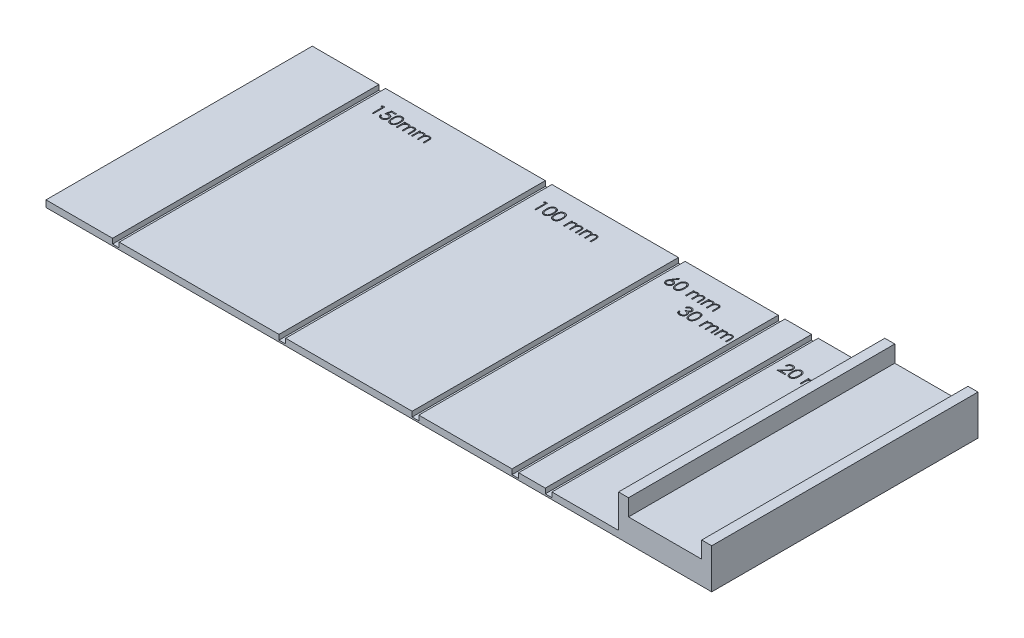
from build123d import *

# Parameters (mm, degrees)
SKETCH1_W           = 200
SKETCH1_H           = 80
BOSS_EXTRUDE1_DEPTH = 2
SKETCH2_W           = 28
SKETCH2_H           = 80
BOSS_EXTRUDE2_DEPTH = 10
SKETCH3_W           = 22
SKETCH3_H           = 80
CUT_EXTRUDE1_DEPTH  = 5
SKETCH4_W           = 2
SKETCH4_H           = 80
CUT_EXTRUDE2_DEPTH  = 1.5


with BuildPart() as part:
    # Sketch1 → Boss-Extrude1 (new body)
    with BuildSketch(Plane(origin=(0, 0, 0), x_dir=(1, 0, 0), z_dir=(0, 1, 0))):
        Rectangle(SKETCH1_W, SKETCH1_H)
    extrude(amount=BOSS_EXTRUDE1_DEPTH)

    # Sketch2 → Boss-Extrude2 (add)
    with BuildSketch(Plane(origin=(0, 2, 0), x_dir=(1, 0, 0), z_dir=(0, 1, 0))):
        with Locations((86, 0)):
            Rectangle(SKETCH2_W, SKETCH2_H)
    extrude(amount=BOSS_EXTRUDE2_DEPTH)

    # Sketch3 → Cut-Extrude1 (cut)
    with BuildSketch(Plane(origin=(0, 12, 0), x_dir=(1, 0, 0), z_dir=(0, 1, 0))):
        with Locations((86, 0)):
            Rectangle(SKETCH3_W, SKETCH3_H)
    extrude(amount=-CUT_EXTRUDE1_DEPTH, mode=Mode.SUBTRACT)

    # Sketch4 → Cut-Extrude2 (cut)
    # profile 1 of 27: a face of its own
    with BuildSketch(Plane(origin=(0, 2, 0), x_dir=(1, 0, 0), z_dir=(0, 1, 0))):
        with Locations((51, 0)):
            Rectangle(SKETCH4_W, SKETCH4_H)
    # profile 2 of 27: a face of its own
    with BuildSketch(Plane(origin=(0, 2, 0), x_dir=(1, 0, 0), z_dir=(0, 1, 0))):
        with Locations((11, 0)):
            Rectangle(SKETCH4_W, SKETCH4_H)
    # profile 3 of 27: a face of its own
    with BuildSketch(Plane(origin=(0, 2, 0), x_dir=(1, 0, 0), z_dir=(0, 1, 0))):
        with Locations((-29, 0)):
            Rectangle(SKETCH4_W, SKETCH4_H)
    # profile 4 of 27: a face of its own
    with BuildSketch(Plane(origin=(0, 2, 0), x_dir=(1, 0, 0), z_dir=(0, 1, 0))):
        with Locations((41, 0)):
            Rectangle(SKETCH4_W, SKETCH4_H)
    # profile 5 of 27: a face of its own
    with BuildSketch(Plane(origin=(0, 2, 0), x_dir=(1, 0, 0), z_dir=(0, 1, 0))):
        with Locations((-79, 0)):
            Rectangle(SKETCH4_W, SKETCH4_H)
    # profile 6 of 27: a face of its own
    with BuildSketch(Plane(origin=(0, 2, 0), x_dir=(1, 0, 0), z_dir=(0, 1, 0))):
        Polygon((-73.891326045, 35.043522729), (-73.244190629, 35.043522729), (-73.244190629, 31.543522729), (-73.558293193, 31.543522729), (-73.558293193, 34.68454837), (-74.096754731, 34.68454837), align=None)
    # profile 7 of 27: a face of its own
    with BuildSketch(Plane(origin=(0, 2, 0), x_dir=(1, 0, 0), z_dir=(0, 1, 0))):
        with BuildLine():
            Line((-69.744190629, 35.043522729), (-69.744190629, 34.68454837))
            Line((-69.744190629, 34.68454837), (-70.933994315, 34.68454837))
            Line((-70.933994315, 34.68454837), (-71.123297199, 33.763975454))
            add(Edge.make_bspline(
                [(-71.123297199, 33.763975454), (-71.086241325, 33.774205725), (-71.014451429, 33.794025259), (-70.908491568, 33.816031029), (-70.807899364, 33.829296473), (-70.742623994, 33.831107784), (-70.711037584, 33.831984268)],
                knots=[0, 0, 0, 0, 1.100273476, 2.13160584, 3.095893838, 4, 4, 4, 4], degree=3))
            add(Edge.make_bspline(
                [(-70.711037584, 33.831984268), (-70.671953844, 33.831138332), (-70.595105447, 33.829475011), (-70.4826665, 33.813503162), (-70.375333607, 33.788363247), (-70.273331236, 33.753242725), (-70.176470686, 33.708332992), (-70.085643124, 33.652233052), (-69.999485211, 33.58669972), (-69.919542617, 33.511354709), (-69.847018309, 33.428433092), (-69.783252319, 33.339275221), (-69.729089729, 33.244747559), (-69.685528974, 33.14394695), (-69.65074464, 33.037987796), (-69.627592645, 32.925755214), (-69.612175936, 32.808307094), (-69.61045355, 32.728002524), (-69.609575244, 32.687052377)],
                knots=[0, 0, 0, 0, 1.052922333, 2.070308379, 3.05430497, 4.020497103, 4.973039431, 5.925935799, 6.892292201, 7.88610001, 8.88166317, 9.857072816, 10.836096531, 11.812156883, 12.81219415, 13.836441305, 14.89672472, 16, 16, 16, 16], degree=3))
            add(Edge.make_bspline(
                [(-69.609575244, 32.687052377), (-69.610240319, 32.658530156), (-69.611561482, 32.601871169), (-69.61828007, 32.517726968), (-69.631215786, 32.435364135), (-69.64858351, 32.354771743), (-69.671125928, 32.276102371), (-69.698414982, 32.199130843), (-69.731811009, 32.124336236), (-69.768442384, 32.051010841), (-69.809688862, 31.980812334), (-69.85546737, 31.915163347), (-69.903832861, 31.853079066), (-69.955874246, 31.795225333), (-70.012075242, 31.741982315), (-70.071755208, 31.693034034), (-70.134437927, 31.647552703), (-70.20109317, 31.607384508), (-70.270235653, 31.570421552), (-70.34286387, 31.540098015), (-70.41732457, 31.512987486), (-70.494689446, 31.491377959), (-70.574783259, 31.474445404), (-70.657738034, 31.462944804), (-70.743118704, 31.454568366), (-70.800993717, 31.454044009), (-70.830228289, 31.453779139)],
                knots=[0, 0, 0, 0, 1.056347294, 2.098418968, 3.122841568, 4.141288669, 5.149314143, 6.15115421, 7.162517403, 8.180376062, 9.185164535, 10.17417709, 11.141909838, 12.097768115, 13.052685741, 14.0056014, 14.954263652, 15.917497458, 16.885230207, 17.854509472, 18.828990115, 19.81800267, 20.826176721, 21.857883937, 22.917946725, 24, 24, 24, 24], degree=3))
            add(Edge.make_bspline(
                [(-70.830228289, 31.453779139), (-70.86510247, 31.454469977), (-70.9337133, 31.45582912), (-71.034233867, 31.470047605), (-71.130948473, 31.490411521), (-71.223078574, 31.521047791), (-71.311449838, 31.559435086), (-71.394872556, 31.607951257), (-71.475478332, 31.662930361), (-71.549990369, 31.727810714), (-71.619146482, 31.798726396), (-71.681052991, 31.875684037), (-71.736186568, 31.957413479), (-71.783664315, 32.044311633), (-71.824162336, 32.136150164), (-71.855977324, 32.233273165), (-71.881655679, 32.335173169), (-71.8925191, 32.405326679), (-71.898036782, 32.440958627)],
                knots=[0, 0, 0, 0, 1.0467383, 2.05933395, 3.04377827, 4.011590433, 4.970194871, 5.932262533, 6.905835911, 7.896367577, 8.894135286, 9.877477877, 10.858688626, 11.851381753, 12.8477658, 13.868841284, 14.917554742, 16, 16, 16, 16], degree=3))
            Line((-71.898036782, 32.440958627), (-71.583934218, 32.440958627))
            add(Edge.make_bspline(
                [(-71.583934218, 32.440958627), (-71.576205661, 32.407582174), (-71.561350945, 32.343430779), (-71.528745196, 32.253299438), (-71.48887932, 32.172980214), (-71.441474972, 32.101410631), (-71.384924941, 32.039001634), (-71.320395512, 31.983384572), (-71.248047789, 31.933209442), (-71.16765456, 31.891386675), (-71.08284148, 31.855717922), (-70.99407427, 31.831966227), (-70.903769924, 31.815265334), (-70.842691554, 31.813593573), (-70.811999122, 31.812753498)],
                knots=[0, 0, 0, 0, 1.136247022, 2.183929868, 3.172523383, 4.106158343, 5.02341133, 5.958108904, 6.928429099, 7.938127109, 8.96079061, 9.975095812, 10.982467395, 12, 12, 12, 12], degree=3))
            add(Edge.make_bspline(
                [(-70.811999122, 31.812753498), (-70.782040678, 31.813574276), (-70.723052256, 31.815190395), (-70.636240869, 31.827629407), (-70.552427995, 31.846786978), (-70.472440638, 31.875456833), (-70.394879098, 31.910301551), (-70.321705328, 31.955016627), (-70.250802451, 32.006476646), (-70.184374317, 32.065433276), (-70.123534868, 32.13040297), (-70.069778747, 32.199880364), (-70.025001833, 32.27399721), (-69.987267725, 32.351470363), (-69.958614426, 32.43314892), (-69.938173445, 32.518650096), (-69.926170386, 32.608185076), (-69.924519206, 32.669254386), (-69.923677808, 32.700373691)],
                knots=[0, 0, 0, 0, 1.027316725, 2.022795036, 3.002884548, 3.971462791, 4.93288096, 5.914575861, 6.907176829, 7.935150275, 8.956128384, 9.956726525, 10.942570165, 11.921478529, 12.907843606, 13.90538589, 14.932640048, 16, 16, 16, 16], degree=3))
            add(Edge.make_bspline(
                [(-69.923677808, 32.700373691), (-69.924336288, 32.728449442), (-69.925625167, 32.783403731), (-69.936155738, 32.863802938), (-69.95447271, 32.93987598), (-69.97989659, 33.011990214), (-70.012176098, 33.080213656), (-70.05162241, 33.144616717), (-70.098975808, 33.20435055), (-70.153067697, 33.259443103), (-70.212325738, 33.310287978), (-70.27776948, 33.353632065), (-70.348029407, 33.390095982), (-70.422259006, 33.421563981), (-70.502223905, 33.444164726), (-70.586340537, 33.461132612), (-70.675517245, 33.470947974), (-70.736487933, 33.472309863), (-70.767828449, 33.473009909)],
                knots=[0, 0, 0, 0, 1.045622112, 2.046656509, 3.013763289, 3.955457236, 4.890082067, 5.820317437, 6.762574623, 7.722996705, 8.69280354, 9.665887285, 10.63943826, 11.638615906, 12.663482002, 13.728887084, 14.832589034, 16, 16, 16, 16], degree=3))
            add(Edge.make_bspline(
                [(-70.767828449, 33.473009909), (-70.794957378, 33.472429317), (-70.850971733, 33.471230544), (-70.93689456, 33.462404047), (-71.027186283, 33.448164753), (-71.121500779, 33.428578505), (-71.220121287, 33.402947429), (-71.322839687, 33.372232928), (-71.429871954, 33.335510929), (-71.501989678, 33.307778715), (-71.539062423, 33.293522729)],
                knots=[0, 0, 0, 0, 0.817624296, 1.688186739, 2.600797293, 3.572016777, 4.590301741, 5.671205678, 6.80286297, 8, 8, 8, 8], degree=3))
            Line((-71.539062423, 33.293522729), (-71.180088065, 35.043522729))
            Line((-71.180088065, 35.043522729), (-69.744190629, 35.043522729))
        make_face()
    # profile 8 of 27: a face of its own
    with BuildSketch(Plane(origin=(0, 2, 0), x_dir=(1, 0, 0), z_dir=(0, 1, 0))):
        with BuildLine():
            add(Edge.make_bspline(
                [(-69.250600885, 33.292120486), (-69.250272867, 33.348217873), (-69.249635687, 33.457187858), (-69.242547266, 33.6159725), (-69.230771924, 33.764932789), (-69.214634551, 33.904075855), (-69.194996571, 34.033437619), (-69.168781084, 34.152672376), (-69.138968281, 34.262331983), (-69.104415836, 34.362774031), (-69.065428047, 34.455351734), (-69.022993786, 34.541776936), (-68.975428991, 34.621918868), (-68.925452078, 34.697056658), (-68.871040007, 34.765960353), (-68.813741216, 34.829603016), (-68.75131934, 34.886513766), (-68.685896332, 34.938360069), (-68.616879867, 34.98380954), (-68.546237201, 35.023842279), (-68.473482095, 35.058042146), (-68.398415913, 35.084932582), (-68.321713355, 35.107143429), (-68.243106288, 35.122332376), (-68.162464924, 35.131889285), (-68.108033489, 35.132802953), (-68.080428609, 35.133266319)],
                knots=[0, 0, 0, 0, 1.646270934, 3.197905019, 4.663502075, 6.030701355, 7.308322542, 8.50163776, 9.611534131, 10.641858119, 11.616356847, 12.558055219, 13.465016945, 14.349605745, 15.204443733, 16.039544428, 16.859896111, 17.680448484, 18.487036065, 19.28249412, 20.06191084, 20.843045899, 21.620316918, 22.403196591, 23.190181807, 24, 24, 24, 24], degree=3))
            add(Edge.make_bspline(
                [(-68.080428609, 35.133266319), (-68.052593131, 35.132778504), (-67.997237122, 35.131808393), (-67.915396747, 35.12248445), (-67.835447065, 35.107013327), (-67.757728926, 35.085092353), (-67.68160394, 35.057896676), (-67.607667532, 35.023809559), (-67.535460451, 34.984130691), (-67.466130163, 34.937506814), (-67.398915548, 34.885524538), (-67.335467585, 34.826761869), (-67.275780499, 34.76181215), (-67.219105193, 34.691370286), (-67.167049596, 34.614085201), (-67.117476164, 34.531301091), (-67.073104128, 34.441570227), (-67.030369453, 34.346389759), (-66.993482466, 34.2431261), (-66.960216221, 34.132361339), (-66.933337252, 34.012787153), (-66.91094798, 33.885030907), (-66.893603084, 33.748623424), (-66.880970442, 33.603857109), (-66.874297357, 33.450636718), (-66.873040656, 33.345878869), (-66.872395757, 33.292120486)],
                knots=[0, 0, 0, 0, 0.810914788, 1.612654377, 2.396697861, 3.181598691, 3.963628158, 4.749916497, 5.551656086, 6.361998678, 7.18212741, 8.025565596, 8.878627764, 9.750805457, 10.657531673, 11.591944965, 12.560506719, 13.57287815, 14.630710178, 15.753379473, 16.941251878, 18.199788006, 19.531962791, 20.947069417, 22.433333509, 24, 24, 24, 24], degree=3))
            add(Edge.make_bspline(
                [(-66.872395757, 33.292120486), (-66.873047341, 33.238596578), (-66.874316927, 33.134307426), (-66.880895634, 32.98177645), (-66.893854265, 32.837778407), (-66.910064254, 32.701967945), (-66.932515217, 32.574910326), (-66.960120383, 32.456165877), (-66.990770706, 32.345221806), (-67.0286055, 32.242986994), (-67.07001621, 32.148035271), (-67.115071406, 32.059368123), (-67.163341232, 31.97620183), (-67.215929977, 31.899202083), (-67.271983391, 31.827823426), (-67.332701179, 31.763325804), (-67.396371764, 31.704155132), (-67.46378418, 31.651503504), (-67.534195731, 31.6054187), (-67.606154808, 31.564204849), (-67.680938192, 31.530972154), (-67.756851144, 31.502437113), (-67.834979511, 31.480636661), (-67.915225901, 31.465562806), (-67.997182137, 31.454990957), (-68.052583702, 31.454184477), (-68.080428609, 31.453779139)],
                knots=[0, 0, 0, 0, 1.561518951, 3.042555995, 4.452378317, 5.7783523, 7.031515105, 8.214008947, 9.334062868, 10.386615937, 11.391082383, 12.354592575, 13.286541444, 14.194233754, 15.072674879, 15.931287219, 16.775624067, 17.606195743, 18.42308326, 19.229000347, 20.022332153, 20.807536673, 21.593273796, 22.3848459, 23.188221202, 24, 24, 24, 24], degree=3))
            add(Edge.make_bspline(
                [(-68.080428609, 31.453779139), (-68.108032723, 31.454245495), (-68.162462648, 31.455165057), (-68.243115074, 31.464678788), (-68.321397517, 31.479974291), (-68.397696271, 31.501390896), (-68.472402786, 31.527605732), (-68.544499073, 31.561759416), (-68.614786756, 31.601093484), (-68.683078313, 31.645888906), (-68.748090474, 31.697210589), (-68.810189079, 31.753974878), (-68.867814098, 31.817598289), (-68.921448194, 31.887076212), (-68.972422282, 31.961769454), (-69.019311655, 32.042697827), (-69.062682509, 32.129540438), (-69.102326, 32.222858349), (-69.137474663, 32.324013277), (-69.168522371, 32.434162455), (-69.193036529, 32.554278091), (-69.214019484, 32.683395458), (-69.230943867, 32.822069389), (-69.242498193, 32.970375167), (-69.249639508, 33.128220376), (-69.250274578, 33.23649015), (-69.250600885, 33.292120486)],
                knots=[0, 0, 0, 0, 0.810891512, 1.598919785, 2.382837074, 3.152667961, 3.926044502, 4.706494248, 5.493654104, 6.291793342, 7.103789334, 7.925228297, 8.761435821, 9.622817696, 10.50288917, 11.416980706, 12.369136599, 13.353924996, 14.394355917, 15.514179734, 16.714354668, 17.994756427, 19.357759367, 20.818452758, 22.365282078, 24, 24, 24, 24], degree=3))
        make_face()
        with BuildLine():
            add(Edge.make_bspline(
                [(-68.936498321, 33.293522729), (-68.936378874, 33.24677403), (-68.936147051, 33.156043986), (-68.93009085, 33.024200725), (-68.921840618, 32.901230396), (-68.911199321, 32.786976859), (-68.895396372, 32.681826847), (-68.877689584, 32.585057164), (-68.856141495, 32.497179927), (-68.830646477, 32.417592116), (-68.80160738, 32.344943047), (-68.769901516, 32.277341832), (-68.735840794, 32.213989896), (-68.697721643, 32.155456287), (-68.65620658, 32.101550123), (-68.612233321, 32.051317291), (-68.564160736, 32.00652031), (-68.497656994, 31.952793455), (-68.409860519, 31.897274321), (-68.299240064, 31.848928231), (-68.185571613, 31.818545775), (-68.108420363, 31.814682019), (-68.069911782, 31.812753498)],
                knots=[0, 0, 0, 0, 1.459021318, 2.831673884, 4.118529203, 5.306027144, 6.411944654, 7.436330062, 8.375795394, 9.233974572, 10.042671642, 10.816086306, 11.563610507, 12.285937304, 12.993564865, 13.685989202, 14.367179055, 15.041617293, 16.353048772, 17.594441528, 18.799311195, 20, 20, 20, 20], degree=3))
            add(Edge.make_bspline(
                [(-68.069911782, 31.812753498), (-68.031154111, 31.814351279), (-67.953718788, 31.817543542), (-67.840584992, 31.848342279), (-67.730754722, 31.894811819), (-67.644682782, 31.949759324), (-67.579200239, 32.002087654), (-67.532283249, 32.046702302), (-67.4892212, 32.096658169), (-67.448379125, 32.150557465), (-67.41092005, 32.209429949), (-67.376856912, 32.272992525), (-67.345773564, 32.341421703), (-67.328064518, 32.389191442), (-67.31901034, 32.413614877)],
                knots=[0, 0, 0, 0, 1.353760809, 2.704726607, 4.075137775, 5.516104923, 6.260822281, 7.007110065, 7.778089737, 8.566572457, 9.372053459, 10.217411131, 11.088608312, 12, 12, 12, 12], degree=3))
            add(Edge.make_bspline(
                [(-67.31901034, 32.413614877), (-67.308458572, 32.444844616), (-67.287033959, 32.50825438), (-67.259422184, 32.606618032), (-67.237676785, 32.709820796), (-67.218113419, 32.817245913), (-67.204760363, 32.929685614), (-67.19401255, 33.046791998), (-67.187681863, 33.16865336), (-67.186897112, 33.251448351), (-67.186498321, 33.293522729)],
                knots=[0, 0, 0, 0, 0.884706709, 1.796334032, 2.740027952, 3.714592787, 4.726048262, 5.777819803, 6.87074269, 8, 8, 8, 8], degree=3))
            add(Edge.make_bspline(
                [(-67.186498321, 33.293522729), (-67.18704851, 33.335590302), (-67.188124798, 33.417883466), (-67.192238786, 33.538401647), (-67.20286236, 33.652869408), (-67.214661479, 33.761779881), (-67.2320587, 33.864530183), (-67.250816507, 33.961980489), (-67.276017719, 34.052923513), (-67.302937494, 34.138783095), (-67.33374789, 34.21858375), (-67.367663624, 34.292697536), (-67.403885383, 34.361482261), (-67.443227623, 34.424749202), (-67.485223306, 34.482781745), (-67.530980855, 34.53441634), (-67.578685228, 34.581253308), (-67.645502414, 34.634715877), (-67.732976704, 34.689227573), (-67.841822351, 34.739393332), (-67.955092996, 34.768201625), (-68.03166645, 34.772263312), (-68.069911782, 34.77429196)],
                knots=[0, 0, 0, 0, 1.31362396, 2.569729283, 3.763502607, 4.902122613, 5.988968491, 7.01645872, 7.998833611, 8.933434873, 9.825090667, 10.667526885, 11.477055099, 12.250526234, 12.991942729, 13.710640831, 14.402115721, 15.076753259, 16.378508321, 17.609869233, 18.806226677, 20, 20, 20, 20], degree=3))
            add(Edge.make_bspline(
                [(-68.069911782, 34.77429196), (-68.108622375, 34.772260513), (-68.18611408, 34.768193919), (-68.300562035, 34.739500666), (-68.410266387, 34.6894877), (-68.497509361, 34.634535327), (-68.564373148, 34.582197016), (-68.611455841, 34.536810562), (-68.655602013, 34.487164307), (-68.696269713, 34.432762392), (-68.734358997, 34.374297025), (-68.769340009, 34.31130826), (-68.800857339, 34.243476896), (-68.829941875, 34.170860461), (-68.855514663, 34.091279516), (-68.876608626, 34.003510523), (-68.896095679, 33.907048631), (-68.909890948, 33.801329123), (-68.922154704, 33.68704697), (-68.930036052, 33.563769651), (-68.93616731, 33.431705271), (-68.936385774, 33.340506112), (-68.936498321, 33.293522729)],
                knots=[0, 0, 0, 0, 1.207732386, 2.417664972, 3.655092373, 4.956220595, 5.625982001, 6.301752483, 6.994047911, 7.697131622, 8.419323945, 9.170223765, 9.943494443, 10.752040957, 11.610060368, 12.549350801, 13.567764191, 14.679664412, 15.874934091, 17.154273443, 18.533957287, 20, 20, 20, 20], degree=3))
        make_face(mode=Mode.SUBTRACT)
    # profile 9 of 27: a face of its own
    with BuildSketch(Plane(origin=(0, 2, 0), x_dir=(1, 0, 0), z_dir=(0, 1, 0))):
        with BuildLine():
            Line((-66.333934218, 34.101215037), (-66.019831654, 34.101215037))
            Line((-66.019831654, 34.101215037), (-66.019831654, 33.656703819))
            add(Edge.make_bspline(
                [(-66.019831654, 33.656703819), (-65.991547704, 33.695591421), (-65.937352945, 33.770103794), (-65.848487292, 33.868294078), (-65.75971118, 33.951622233), (-65.695777798, 33.995365104), (-65.665064026, 34.0163793)],
                knots=[0, 0, 0, 0, 1.134379233, 2.173579362, 3.122582517, 4, 4, 4, 4], degree=3))
            add(Edge.make_bspline(
                [(-65.665064026, 34.0163793), (-65.623199364, 34.036384665), (-65.540201464, 34.076045878), (-65.408782239, 34.116279437), (-65.27430757, 34.141004539), (-65.183499356, 34.144385912), (-65.137820436, 34.146086832)],
                knots=[0, 0, 0, 0, 1.014936303, 2.012140481, 3.000054389, 4, 4, 4, 4], degree=3))
            add(Edge.make_bspline(
                [(-65.137820436, 34.146086832), (-65.10692744, 34.145041541), (-65.045791861, 34.142972967), (-64.955207771, 34.129512932), (-64.867349159, 34.106246758), (-64.782735129, 34.073839435), (-64.70301445, 34.034592748), (-64.629925252, 33.98854304), (-64.564301044, 33.936845964), (-64.506174993, 33.877167031), (-64.453905968, 33.807830433), (-64.405827121, 33.726966184), (-64.361401909, 33.632758523), (-64.3367806, 33.564391982), (-64.323818032, 33.52839853)],
                knots=[0, 0, 0, 0, 1.009824226, 1.998387844, 2.986035974, 3.974953746, 4.955485308, 5.885931332, 6.793869504, 7.679848016, 8.601185859, 9.625726857, 10.749998409, 12, 12, 12, 12], degree=3))
            add(Edge.make_bspline(
                [(-64.323818032, 33.52839853), (-64.310106781, 33.55312295), (-64.283124964, 33.601777135), (-64.237819327, 33.670635397), (-64.19035153, 33.735042189), (-64.140317037, 33.795048613), (-64.087892451, 33.850358344), (-64.03283105, 33.901154245), (-63.975446269, 33.947654459), (-63.895654029, 34.001977618), (-63.791841422, 34.0596788), (-63.660953307, 34.109707244), (-63.524803135, 34.140623372), (-63.432385437, 34.144253645), (-63.385717071, 34.146086832)],
                knots=[0, 0, 0, 0, 0.86119277, 1.694706429, 2.50939023, 3.298075842, 4.073795165, 4.829715201, 5.57930267, 6.321991688, 7.768977793, 9.186738141, 10.579381044, 12, 12, 12, 12], degree=3))
            add(Edge.make_bspline(
                [(-63.385717071, 34.146086832), (-63.342835608, 34.144469611), (-63.258912422, 34.141304553), (-63.136735156, 34.116451079), (-63.022793351, 34.073773432), (-62.917316275, 34.015539796), (-62.822156461, 33.942360612), (-62.739440152, 33.855291775), (-62.669669789, 33.754949152), (-62.624091149, 33.660557163), (-62.593175885, 33.57722183), (-62.574114651, 33.506215539), (-62.557274955, 33.428063986), (-62.54329371, 33.342673724), (-62.533075158, 33.249743116), (-62.525504443, 33.14942424), (-62.520380369, 33.041639129), (-62.520018297, 32.967273628), (-62.519831654, 32.928939396)],
                knots=[0, 0, 0, 0, 1.209669288, 2.367440248, 3.500751976, 4.631527125, 5.755587489, 6.87532382, 8.007944318, 9.190864318, 9.82315674, 10.514484317, 11.263564316, 12.079023757, 12.955305781, 13.901327259, 14.918167583, 16, 16, 16, 16], degree=3))
            Line((-62.519831654, 32.928939396), (-62.519831654, 31.543522729))
            Line((-62.519831654, 31.543522729), (-62.833934218, 31.543522729))
            Line((-62.833934218, 31.543522729), (-62.833934218, 32.930341639))
            add(Edge.make_bspline(
                [(-62.833934218, 32.930341639), (-62.834012101, 32.963062213), (-62.834161781, 33.02594618), (-62.836855412, 33.116198631), (-62.841930726, 33.198466989), (-62.847865365, 33.272639077), (-62.856109174, 33.338887865), (-62.866755106, 33.397080284), (-62.878032786, 33.447674095), (-62.896768777, 33.503760143), (-62.926716669, 33.565630353), (-62.972334149, 33.632353929), (-63.029804255, 33.690434729), (-63.096164412, 33.740853046), (-63.171712856, 33.781846687), (-63.254977579, 33.811122697), (-63.345441631, 33.829245575), (-63.408064419, 33.831051591), (-63.440404571, 33.831984268)],
                knots=[0, 0, 0, 0, 1.253487763, 2.409012846, 3.458416907, 4.410876679, 5.259312806, 6.014470957, 6.676830364, 7.243083969, 8.276244668, 9.299465089, 10.325150304, 11.392391894, 12.482080715, 13.603491619, 14.762376348, 16, 16, 16, 16], degree=3))
            add(Edge.make_bspline(
                [(-63.440404571, 33.831984268), (-63.480074525, 33.83056811), (-63.558477436, 33.827769245), (-63.672922923, 33.799195372), (-63.782893939, 33.756115121), (-63.885109072, 33.693682664), (-63.979136863, 33.6188743), (-64.060036441, 33.529924704), (-64.126868626, 33.429294778), (-64.172122602, 33.336148075), (-64.200711903, 33.252478631), (-64.219588819, 33.179381259), (-64.234272211, 33.096299692), (-64.24804274, 33.003792201), (-64.257030468, 32.90122202), (-64.26519884, 32.789063619), (-64.269019703, 32.66697966), (-64.269554162, 32.582352971), (-64.269831654, 32.538414556)],
                knots=[0, 0, 0, 0, 1.090531906, 2.155305635, 3.229839962, 4.33261226, 5.44038871, 6.529323825, 7.629011124, 8.757537029, 9.370236727, 10.061839251, 10.834451254, 11.692844982, 12.636905849, 13.66920014, 14.789842145, 16, 16, 16, 16], degree=3))
            Line((-64.269831654, 32.538414556), (-64.269831654, 31.543522729))
            Line((-64.269831654, 31.543522729), (-64.583934218, 31.543522729))
            Line((-64.583934218, 31.543522729), (-64.583934218, 32.844103659))
            add(Edge.make_bspline(
                [(-64.583934218, 32.844103659), (-64.584013649, 32.880796977), (-64.584166467, 32.951391235), (-64.586842784, 33.05262491), (-64.591929406, 33.14470599), (-64.597809954, 33.227527454), (-64.606270132, 33.300938783), (-64.615879895, 33.365333541), (-64.627228505, 33.420550292), (-64.64601839, 33.481113677), (-64.674732858, 33.5478346), (-64.72092112, 33.618975621), (-64.7785287, 33.681243718), (-64.846099576, 33.734402467), (-64.922105258, 33.778343948), (-65.006088659, 33.8100037), (-65.097293572, 33.828427989), (-65.160171278, 33.830776486), (-65.192507936, 33.831984268)],
                knots=[0, 0, 0, 0, 1.320475261, 2.540461679, 3.643808994, 4.639130445, 5.527981419, 6.302341397, 6.981980563, 7.553956391, 8.582137848, 9.585246428, 10.591171744, 11.620968678, 12.668337649, 13.738356861, 14.836885341, 16, 16, 16, 16], degree=3))
            add(Edge.make_bspline(
                [(-65.192507936, 33.831984268), (-65.230524148, 33.830453808), (-65.306289107, 33.827403655), (-65.417591077, 33.799949381), (-65.52507676, 33.756945307), (-65.627031459, 33.697285487), (-65.720705608, 33.623386409), (-65.802713875, 33.536471513), (-65.8716564, 33.43762248), (-65.917388215, 33.345457963), (-65.946886689, 33.263884688), (-65.966482024, 33.19453374), (-65.98332165, 33.117533492), (-65.995835672, 33.032646381), (-66.007916087, 32.940425287), (-66.013746396, 32.840410797), (-66.019417958, 32.73268871), (-66.019690373, 32.658316164), (-66.019831654, 32.619744684)],
                knots=[0, 0, 0, 0, 1.098833095, 2.189935336, 3.297829714, 4.440610912, 5.596351641, 6.740013378, 7.886572111, 9.072425424, 9.705826452, 10.395263256, 11.156850408, 11.985370555, 12.878090359, 13.847760091, 14.883794034, 16, 16, 16, 16], degree=3))
            Line((-66.019831654, 32.619744684), (-66.019831654, 31.543522729))
            Line((-66.019831654, 31.543522729), (-66.333934218, 31.543522729))
            Line((-66.333934218, 31.543522729), (-66.333934218, 34.101215037))
        make_face()
    # profile 10 of 27: a face of its own
    with BuildSketch(Plane(origin=(0, 2, 0), x_dir=(1, 0, 0), z_dir=(0, 1, 0))):
        with BuildLine():
            Line((-61.801882936, 34.101215037), (-61.487780372, 34.101215037))
            Line((-61.487780372, 34.101215037), (-61.487780372, 33.656703819))
            add(Edge.make_bspline(
                [(-61.487780372, 33.656703819), (-61.459496422, 33.695591421), (-61.405301663, 33.770103794), (-61.31643601, 33.868294078), (-61.227659898, 33.951622233), (-61.163726516, 33.995365104), (-61.133012744, 34.0163793)],
                knots=[0, 0, 0, 0, 1.134379233, 2.173579362, 3.122582517, 4, 4, 4, 4], degree=3))
            add(Edge.make_bspline(
                [(-61.133012744, 34.0163793), (-61.091148082, 34.036384665), (-61.008150182, 34.076045878), (-60.876730957, 34.116279437), (-60.742256288, 34.141004539), (-60.651448074, 34.144385912), (-60.605769154, 34.146086832)],
                knots=[0, 0, 0, 0, 1.014936303, 2.012140481, 3.000054389, 4, 4, 4, 4], degree=3))
            add(Edge.make_bspline(
                [(-60.605769154, 34.146086832), (-60.574876158, 34.145041541), (-60.513740579, 34.142972967), (-60.423156489, 34.129512932), (-60.335297877, 34.106246758), (-60.250683847, 34.073839435), (-60.170963168, 34.034592748), (-60.09787397, 33.98854304), (-60.032249762, 33.936845964), (-59.974123711, 33.877167031), (-59.921854685, 33.807830433), (-59.873775839, 33.726966184), (-59.829350626, 33.632758523), (-59.804729318, 33.564391982), (-59.79176675, 33.52839853)],
                knots=[0, 0, 0, 0, 1.009824226, 1.998387844, 2.986035974, 3.974953746, 4.955485308, 5.885931332, 6.793869504, 7.679848016, 8.601185859, 9.625726857, 10.749998409, 12, 12, 12, 12], degree=3))
            add(Edge.make_bspline(
                [(-59.79176675, 33.52839853), (-59.778055499, 33.55312295), (-59.751073682, 33.601777135), (-59.705768045, 33.670635397), (-59.658300248, 33.735042189), (-59.608265755, 33.795048613), (-59.555841168, 33.850358344), (-59.500779768, 33.901154245), (-59.443394987, 33.947654459), (-59.363602747, 34.001977618), (-59.259790139, 34.0596788), (-59.128902025, 34.109707244), (-58.992751853, 34.140623372), (-58.900334155, 34.144253645), (-58.853665789, 34.146086832)],
                knots=[0, 0, 0, 0, 0.86119277, 1.694706429, 2.50939023, 3.298075842, 4.073795165, 4.829715201, 5.57930267, 6.321991688, 7.768977793, 9.186738141, 10.579381044, 12, 12, 12, 12], degree=3))
            add(Edge.make_bspline(
                [(-58.853665789, 34.146086832), (-58.810784326, 34.144469611), (-58.72686114, 34.141304553), (-58.604683874, 34.116451079), (-58.490742069, 34.073773432), (-58.385264993, 34.015539796), (-58.290105179, 33.942360612), (-58.20738887, 33.855291775), (-58.137618507, 33.754949152), (-58.092039867, 33.660557163), (-58.061124603, 33.57722183), (-58.042063368, 33.506215539), (-58.025223673, 33.428063986), (-58.011242428, 33.342673724), (-58.001023876, 33.249743116), (-57.993453161, 33.14942424), (-57.988329087, 33.041639129), (-57.987967015, 32.967273628), (-57.987780372, 32.928939396)],
                knots=[0, 0, 0, 0, 1.209669288, 2.367440248, 3.500751976, 4.631527125, 5.755587489, 6.87532382, 8.007944318, 9.190864318, 9.82315674, 10.514484317, 11.263564316, 12.079023757, 12.955305781, 13.901327259, 14.918167583, 16, 16, 16, 16], degree=3))
            Line((-57.987780372, 32.928939396), (-57.987780372, 31.543522729))
            Line((-57.987780372, 31.543522729), (-58.301882936, 31.543522729))
            Line((-58.301882936, 31.543522729), (-58.301882936, 32.930341639))
            add(Edge.make_bspline(
                [(-58.301882936, 32.930341639), (-58.301960819, 32.963062213), (-58.302110499, 33.02594618), (-58.30480413, 33.116198631), (-58.309879444, 33.198466989), (-58.315814083, 33.272639077), (-58.324057892, 33.338887865), (-58.334703824, 33.397080284), (-58.345981504, 33.447674095), (-58.364717495, 33.503760143), (-58.394665387, 33.565630353), (-58.440282867, 33.632353929), (-58.497752973, 33.690434729), (-58.56411313, 33.740853046), (-58.639661574, 33.781846687), (-58.722926297, 33.811122697), (-58.813390349, 33.829245575), (-58.876013137, 33.831051591), (-58.908353289, 33.831984268)],
                knots=[0, 0, 0, 0, 1.253487763, 2.409012846, 3.458416907, 4.410876679, 5.259312806, 6.014470957, 6.676830364, 7.243083969, 8.276244668, 9.299465089, 10.325150304, 11.392391894, 12.482080715, 13.603491619, 14.762376348, 16, 16, 16, 16], degree=3))
            add(Edge.make_bspline(
                [(-58.908353289, 33.831984268), (-58.948023243, 33.83056811), (-59.026426154, 33.827769245), (-59.140871641, 33.799195372), (-59.250842657, 33.756115121), (-59.35305779, 33.693682664), (-59.447085581, 33.6188743), (-59.527985159, 33.529924704), (-59.594817344, 33.429294778), (-59.64007132, 33.336148075), (-59.668660621, 33.252478631), (-59.687537537, 33.179381259), (-59.702220929, 33.096299692), (-59.715991458, 33.003792201), (-59.724979186, 32.90122202), (-59.733147558, 32.789063619), (-59.736968421, 32.66697966), (-59.73750288, 32.582352971), (-59.737780372, 32.538414556)],
                knots=[0, 0, 0, 0, 1.090531906, 2.155305635, 3.229839962, 4.33261226, 5.44038871, 6.529323825, 7.629011124, 8.757537029, 9.370236727, 10.061839251, 10.834451254, 11.692844982, 12.636905849, 13.66920014, 14.789842145, 16, 16, 16, 16], degree=3))
            Line((-59.737780372, 32.538414556), (-59.737780372, 31.543522729))
            Line((-59.737780372, 31.543522729), (-60.051882936, 31.543522729))
            Line((-60.051882936, 31.543522729), (-60.051882936, 32.844103659))
            add(Edge.make_bspline(
                [(-60.051882936, 32.844103659), (-60.051962367, 32.880796977), (-60.052115185, 32.951391235), (-60.054791502, 33.05262491), (-60.059878124, 33.14470599), (-60.065758672, 33.227527454), (-60.07421885, 33.300938783), (-60.083828613, 33.365333541), (-60.095177223, 33.420550292), (-60.113967108, 33.481113677), (-60.142681576, 33.5478346), (-60.188869838, 33.618975621), (-60.246477418, 33.681243718), (-60.314048294, 33.734402467), (-60.390053976, 33.778343948), (-60.474037377, 33.8100037), (-60.56524229, 33.828427989), (-60.628119996, 33.830776486), (-60.660456654, 33.831984268)],
                knots=[0, 0, 0, 0, 1.320475261, 2.540461679, 3.643808994, 4.639130445, 5.527981419, 6.302341397, 6.981980563, 7.553956391, 8.582137848, 9.585246428, 10.591171744, 11.620968678, 12.668337649, 13.738356861, 14.836885341, 16, 16, 16, 16], degree=3))
            add(Edge.make_bspline(
                [(-60.660456654, 33.831984268), (-60.698472866, 33.830453808), (-60.774237825, 33.827403655), (-60.885539795, 33.799949381), (-60.993025478, 33.756945307), (-61.094980177, 33.697285487), (-61.188654325, 33.623386409), (-61.270662593, 33.536471513), (-61.339605118, 33.43762248), (-61.385336933, 33.345457963), (-61.414835407, 33.263884688), (-61.434430742, 33.19453374), (-61.451270368, 33.117533492), (-61.46378439, 33.032646381), (-61.475864805, 32.940425287), (-61.481695114, 32.840410797), (-61.487366676, 32.73268871), (-61.487639091, 32.658316164), (-61.487780372, 32.619744684)],
                knots=[0, 0, 0, 0, 1.098833095, 2.189935336, 3.297829714, 4.440610912, 5.596351641, 6.740013378, 7.886572111, 9.072425424, 9.705826452, 10.395263256, 11.156850408, 11.985370555, 12.878090359, 13.847760091, 14.883794034, 16, 16, 16, 16], degree=3))
            Line((-61.487780372, 32.619744684), (-61.487780372, 31.543522729))
            Line((-61.487780372, 31.543522729), (-61.801882936, 31.543522729))
            Line((-61.801882936, 31.543522729), (-61.801882936, 34.101215037))
        make_face()
    # profile 11 of 27: a face of its own
    with BuildSketch(Plane(origin=(0, 2, 0), x_dir=(1, 0, 0), z_dir=(0, 1, 0))):
        Polygon((-24.434197816, 34.459383419), (-23.787062399, 34.459383419), (-23.787062399, 30.959383419), (-24.101164963, 30.959383419), (-24.101164963, 34.10040906), (-24.639626502, 34.10040906), align=None)
    # profile 12 of 27: a face of its own
    with BuildSketch(Plane(origin=(0, 2, 0), x_dir=(1, 0, 0), z_dir=(0, 1, 0))):
        with BuildLine():
            add(Edge.make_bspline(
                [(-22.485780348, 32.707981176), (-22.48545233, 32.764078563), (-22.48481515, 32.873048548), (-22.477726729, 33.03183319), (-22.465951386, 33.180793479), (-22.449814013, 33.319936545), (-22.430176033, 33.449298309), (-22.403960547, 33.568533066), (-22.374147744, 33.678192673), (-22.339595298, 33.778634722), (-22.300607509, 33.871212425), (-22.258173248, 33.957637626), (-22.210608454, 34.037779558), (-22.160631541, 34.112917349), (-22.106219469, 34.181821043), (-22.048920679, 34.245463706), (-21.986498803, 34.302374456), (-21.921075794, 34.354220759), (-21.85205933, 34.39967023), (-21.781416664, 34.439702969), (-21.708661558, 34.473902836), (-21.633595375, 34.500793272), (-21.556892817, 34.523004119), (-21.478285751, 34.538193067), (-21.397644387, 34.547749975), (-21.343212952, 34.548663643), (-21.315608072, 34.549127009)],
                knots=[0, 0, 0, 0, 1.646270934, 3.197905019, 4.663502075, 6.030701355, 7.308322542, 8.50163776, 9.611534131, 10.641858119, 11.616356847, 12.558055219, 13.465016945, 14.349605745, 15.204443733, 16.039544428, 16.859896111, 17.680448484, 18.487036065, 19.28249412, 20.06191084, 20.843045899, 21.620316918, 22.403196591, 23.190181807, 24, 24, 24, 24], degree=3))
            add(Edge.make_bspline(
                [(-21.315608072, 34.549127009), (-21.287772594, 34.548639194), (-21.232416585, 34.547669083), (-21.150576209, 34.53834514), (-21.070626528, 34.522874017), (-20.992908389, 34.500953043), (-20.916783403, 34.473757366), (-20.842846995, 34.439670249), (-20.770639913, 34.399991382), (-20.701309626, 34.353367504), (-20.63409501, 34.301385228), (-20.570647047, 34.242622559), (-20.510959962, 34.17767284), (-20.454284656, 34.107230976), (-20.402229059, 34.029945891), (-20.352655627, 33.947161782), (-20.308283591, 33.857430917), (-20.265548916, 33.762250449), (-20.228661929, 33.65898679), (-20.195395684, 33.54822203), (-20.168516715, 33.428647843), (-20.146127443, 33.300891597), (-20.128782547, 33.164484114), (-20.116149905, 33.019717799), (-20.10947682, 32.866497408), (-20.108220118, 32.761739559), (-20.107575219, 32.707981176)],
                knots=[0, 0, 0, 0, 0.810914788, 1.612654377, 2.396697861, 3.181598691, 3.963628158, 4.749916497, 5.551656086, 6.361998678, 7.18212741, 8.025565596, 8.878627764, 9.750805457, 10.657531673, 11.591944965, 12.560506719, 13.57287815, 14.630710178, 15.753379473, 16.941251878, 18.199788006, 19.531962791, 20.947069417, 22.433333509, 24, 24, 24, 24], degree=3))
            add(Edge.make_bspline(
                [(-20.107575219, 32.707981176), (-20.108226804, 32.654457268), (-20.10949639, 32.550168116), (-20.116075097, 32.397637141), (-20.129033728, 32.253639097), (-20.145243716, 32.117828635), (-20.167694679, 31.990771016), (-20.195299845, 31.872026568), (-20.225950168, 31.761082496), (-20.263784962, 31.658847684), (-20.305195673, 31.563895961), (-20.350250869, 31.475228813), (-20.398520695, 31.39206252), (-20.45110944, 31.315062773), (-20.507162853, 31.243684116), (-20.567880642, 31.179186494), (-20.631551227, 31.120015822), (-20.698963643, 31.067364194), (-20.769375194, 31.02127939), (-20.841334271, 30.980065539), (-20.916117654, 30.946832844), (-20.992030607, 30.918297803), (-21.070158973, 30.896497351), (-21.150405364, 30.881423496), (-21.2323616, 30.870851647), (-21.287763165, 30.870045168), (-21.315608072, 30.86963983)],
                knots=[0, 0, 0, 0, 1.561518951, 3.042555995, 4.452378317, 5.7783523, 7.031515105, 8.214008947, 9.334062868, 10.386615937, 11.391082383, 12.354592575, 13.286541444, 14.194233754, 15.072674879, 15.931287219, 16.775624067, 17.606195743, 18.42308326, 19.229000347, 20.022332153, 20.807536673, 21.593273796, 22.3848459, 23.188221202, 24, 24, 24, 24], degree=3))
            add(Edge.make_bspline(
                [(-21.315608072, 30.86963983), (-21.343212186, 30.870106185), (-21.397642111, 30.871025747), (-21.478294536, 30.880539478), (-21.55657698, 30.895834982), (-21.632875734, 30.917251586), (-21.707582249, 30.943466422), (-21.779678535, 30.977620106), (-21.849966219, 31.016954175), (-21.918257775, 31.061749596), (-21.983269936, 31.113071279), (-22.045368542, 31.169835568), (-22.102993561, 31.233458979), (-22.156627656, 31.302936902), (-22.207601744, 31.377630145), (-22.254491118, 31.458558518), (-22.297861972, 31.545401128), (-22.337505462, 31.638719039), (-22.372654126, 31.739873967), (-22.403701834, 31.850023145), (-22.428215992, 31.970138781), (-22.449198947, 32.099256148), (-22.46612333, 32.237930079), (-22.477677655, 32.386235857), (-22.48481897, 32.544081066), (-22.485454041, 32.65235084), (-22.485780348, 32.707981176)],
                knots=[0, 0, 0, 0, 0.810891512, 1.598919785, 2.382837074, 3.152667961, 3.926044502, 4.706494248, 5.493654104, 6.291793342, 7.103789334, 7.925228297, 8.761435821, 9.622817696, 10.50288917, 11.416980706, 12.369136599, 13.353924996, 14.394355917, 15.514179734, 16.714354668, 17.994756427, 19.357759367, 20.818452758, 22.365282078, 24, 24, 24, 24], degree=3))
        make_face()
        with BuildLine():
            add(Edge.make_bspline(
                [(-22.171677784, 32.709383419), (-22.171558337, 32.662634721), (-22.171326513, 32.571904676), (-22.165270313, 32.440061415), (-22.157020081, 32.317091086), (-22.146378783, 32.202837549), (-22.130575835, 32.097687537), (-22.112869047, 32.000917854), (-22.091320957, 31.913040617), (-22.06582594, 31.833452806), (-22.036786843, 31.760803738), (-22.005080979, 31.693202522), (-21.971020256, 31.629850586), (-21.932901106, 31.571316978), (-21.891386042, 31.517410814), (-21.847412783, 31.467177981), (-21.799340199, 31.422381), (-21.732836456, 31.368654145), (-21.645039982, 31.313135011), (-21.534419527, 31.264788921), (-21.420751076, 31.234406465), (-21.343599826, 31.230542709), (-21.305091245, 31.228614189)],
                knots=[0, 0, 0, 0, 1.459021318, 2.831673884, 4.118529203, 5.306027144, 6.411944654, 7.436330062, 8.375795394, 9.233974572, 10.042671642, 10.816086306, 11.563610507, 12.285937304, 12.993564865, 13.685989202, 14.367179055, 15.041617293, 16.353048772, 17.594441528, 18.799311195, 20, 20, 20, 20], degree=3))
            add(Edge.make_bspline(
                [(-21.305091245, 31.228614189), (-21.266333573, 31.230211969), (-21.18889825, 31.233404232), (-21.075764455, 31.26420297), (-20.965934185, 31.310672509), (-20.879862245, 31.365620014), (-20.814379701, 31.417948344), (-20.767462711, 31.462562992), (-20.724400663, 31.51251886), (-20.683558588, 31.566418155), (-20.646099512, 31.62529064), (-20.612036375, 31.688853215), (-20.580953027, 31.757282393), (-20.563243981, 31.805052132), (-20.554189803, 31.829475567)],
                knots=[0, 0, 0, 0, 1.353760809, 2.704726607, 4.075137775, 5.516104923, 6.260822281, 7.007110065, 7.778089737, 8.566572457, 9.372053459, 10.217411131, 11.088608312, 12, 12, 12, 12], degree=3))
            add(Edge.make_bspline(
                [(-20.554189803, 31.829475567), (-20.543638035, 31.860705306), (-20.522213421, 31.92411507), (-20.494601647, 32.022478723), (-20.472856248, 32.125681487), (-20.453292882, 32.233106603), (-20.439939826, 32.345546304), (-20.429192013, 32.462652688), (-20.422861326, 32.58451405), (-20.422076575, 32.667309042), (-20.421677784, 32.709383419)],
                knots=[0, 0, 0, 0, 0.884706709, 1.796334032, 2.740027952, 3.714592787, 4.726048262, 5.777819803, 6.87074269, 8, 8, 8, 8], degree=3))
            add(Edge.make_bspline(
                [(-20.421677784, 32.709383419), (-20.422227973, 32.751450992), (-20.423304261, 32.833744157), (-20.427418248, 32.954262337), (-20.438041823, 33.068730098), (-20.449840942, 33.177640571), (-20.467238163, 33.280390874), (-20.48599597, 33.377841179), (-20.511197182, 33.468784204), (-20.538116957, 33.554643785), (-20.568927352, 33.63444444), (-20.602843087, 33.708558226), (-20.639064845, 33.777342951), (-20.678407086, 33.840609893), (-20.720402769, 33.898642435), (-20.766160318, 33.95027703), (-20.813864691, 33.997113998), (-20.880681877, 34.050576567), (-20.968156167, 34.105088263), (-21.077001814, 34.155254023), (-21.190272458, 34.184062315), (-21.266845912, 34.188124002), (-21.305091245, 34.19015265)],
                knots=[0, 0, 0, 0, 1.31362396, 2.569729283, 3.763502607, 4.902122613, 5.988968491, 7.01645872, 7.998833611, 8.933434873, 9.825090667, 10.667526885, 11.477055099, 12.250526234, 12.991942729, 13.710640831, 14.402115721, 15.076753259, 16.378508321, 17.609869233, 18.806226677, 20, 20, 20, 20], degree=3))
            add(Edge.make_bspline(
                [(-21.305091245, 34.19015265), (-21.343801837, 34.188121203), (-21.421293543, 34.184054609), (-21.535741498, 34.155361356), (-21.645445849, 34.10534839), (-21.732688824, 34.050396017), (-21.79955261, 33.998057706), (-21.846635304, 33.952671252), (-21.890781476, 33.903024998), (-21.931449176, 33.848623083), (-21.969538459, 33.790157715), (-22.004519472, 33.727168951), (-22.036036802, 33.659337586), (-22.065121338, 33.586721151), (-22.090694126, 33.507140207), (-22.111788089, 33.419371213), (-22.131275142, 33.322909321), (-22.145070411, 33.217189813), (-22.157334167, 33.10290766), (-22.165215515, 32.979630342), (-22.171346772, 32.847565961), (-22.171565237, 32.756366803), (-22.171677784, 32.709383419)],
                knots=[0, 0, 0, 0, 1.207732386, 2.417664972, 3.655092373, 4.956220595, 5.625982001, 6.301752483, 6.994047911, 7.697131622, 8.419323945, 9.170223765, 9.943494443, 10.752040957, 11.610060368, 12.549350801, 13.567764191, 14.679664412, 15.874934091, 17.154273443, 18.533957287, 20, 20, 20, 20], degree=3))
        make_face(mode=Mode.SUBTRACT)
    # profile 13 of 27: a face of its own
    with BuildSketch(Plane(origin=(0, 2, 0), x_dir=(1, 0, 0), z_dir=(0, 1, 0))):
        with BuildLine():
            add(Edge.make_bspline(
                [(-19.793472655, 32.707981176), (-19.793144637, 32.764078563), (-19.792507457, 32.873048548), (-19.785419036, 33.03183319), (-19.773643694, 33.180793479), (-19.757506321, 33.319936545), (-19.737868341, 33.449298309), (-19.711652854, 33.568533066), (-19.681840052, 33.678192673), (-19.647287606, 33.778634722), (-19.608299817, 33.871212425), (-19.565865556, 33.957637626), (-19.518300762, 34.037779558), (-19.468323849, 34.112917349), (-19.413911777, 34.181821043), (-19.356612987, 34.245463706), (-19.29419111, 34.302374456), (-19.228768102, 34.354220759), (-19.159751638, 34.39967023), (-19.089108972, 34.439702969), (-19.016353866, 34.473902836), (-18.941287683, 34.500793272), (-18.864585125, 34.523004119), (-18.785978058, 34.538193067), (-18.705336694, 34.547749975), (-18.65090526, 34.548663643), (-18.62330038, 34.549127009)],
                knots=[0, 0, 0, 0, 1.646270934, 3.197905019, 4.663502075, 6.030701355, 7.308322542, 8.50163776, 9.611534131, 10.641858119, 11.616356847, 12.558055219, 13.465016945, 14.349605745, 15.204443733, 16.039544428, 16.859896111, 17.680448484, 18.487036065, 19.28249412, 20.06191084, 20.843045899, 21.620316918, 22.403196591, 23.190181807, 24, 24, 24, 24], degree=3))
            add(Edge.make_bspline(
                [(-18.62330038, 34.549127009), (-18.595464901, 34.548639194), (-18.540108892, 34.547669083), (-18.458268517, 34.53834514), (-18.378318835, 34.522874017), (-18.300600697, 34.500953043), (-18.22447571, 34.473757366), (-18.150539303, 34.439670249), (-18.078332221, 34.399991382), (-18.009001933, 34.353367504), (-17.941787318, 34.301385228), (-17.878339355, 34.242622559), (-17.818652269, 34.17767284), (-17.761976964, 34.107230976), (-17.709921367, 34.029945891), (-17.660347934, 33.947161782), (-17.615975898, 33.857430917), (-17.573241223, 33.762250449), (-17.536354237, 33.65898679), (-17.503087991, 33.54822203), (-17.476209023, 33.428647843), (-17.45381975, 33.300891597), (-17.436474854, 33.164484114), (-17.423842212, 33.019717799), (-17.417169127, 32.866497408), (-17.415912426, 32.761739559), (-17.415267527, 32.707981176)],
                knots=[0, 0, 0, 0, 0.810914788, 1.612654377, 2.396697861, 3.181598691, 3.963628158, 4.749916497, 5.551656086, 6.361998678, 7.18212741, 8.025565596, 8.878627764, 9.750805457, 10.657531673, 11.591944965, 12.560506719, 13.57287815, 14.630710178, 15.753379473, 16.941251878, 18.199788006, 19.531962791, 20.947069417, 22.433333509, 24, 24, 24, 24], degree=3))
            add(Edge.make_bspline(
                [(-17.415267527, 32.707981176), (-17.415919112, 32.654457268), (-17.417188698, 32.550168116), (-17.423767404, 32.397637141), (-17.436726036, 32.253639097), (-17.452936024, 32.117828635), (-17.475386987, 31.990771016), (-17.502992153, 31.872026568), (-17.533642476, 31.761082496), (-17.57147727, 31.658847684), (-17.61288798, 31.563895961), (-17.657943177, 31.475228813), (-17.706213003, 31.39206252), (-17.758801748, 31.315062773), (-17.814855161, 31.243684116), (-17.87557295, 31.179186494), (-17.939243535, 31.120015822), (-18.006655951, 31.067364194), (-18.077067502, 31.02127939), (-18.149026579, 30.980065539), (-18.223809962, 30.946832844), (-18.299722915, 30.918297803), (-18.377851281, 30.896497351), (-18.458097672, 30.881423496), (-18.540053908, 30.870851647), (-18.595455473, 30.870045168), (-18.62330038, 30.86963983)],
                knots=[0, 0, 0, 0, 1.561518951, 3.042555995, 4.452378317, 5.7783523, 7.031515105, 8.214008947, 9.334062868, 10.386615937, 11.391082383, 12.354592575, 13.286541444, 14.194233754, 15.072674879, 15.931287219, 16.775624067, 17.606195743, 18.42308326, 19.229000347, 20.022332153, 20.807536673, 21.593273796, 22.3848459, 23.188221202, 24, 24, 24, 24], degree=3))
            add(Edge.make_bspline(
                [(-18.62330038, 30.86963983), (-18.650904494, 30.870106185), (-18.705334419, 30.871025747), (-18.785986844, 30.880539478), (-18.864269287, 30.895834982), (-18.940568041, 30.917251586), (-19.015274557, 30.943466422), (-19.087370843, 30.977620106), (-19.157658527, 31.016954175), (-19.225950083, 31.061749596), (-19.290962244, 31.113071279), (-19.353060849, 31.169835568), (-19.410685868, 31.233458979), (-19.464319964, 31.302936902), (-19.515294052, 31.377630145), (-19.562183425, 31.458558518), (-19.60555428, 31.545401128), (-19.64519777, 31.638719039), (-19.680346434, 31.739873967), (-19.711394142, 31.850023145), (-19.735908299, 31.970138781), (-19.756891255, 32.099256148), (-19.773815638, 32.237930079), (-19.785369963, 32.386235857), (-19.792511278, 32.544081066), (-19.793146348, 32.65235084), (-19.793472655, 32.707981176)],
                knots=[0, 0, 0, 0, 0.810891512, 1.598919785, 2.382837074, 3.152667961, 3.926044502, 4.706494248, 5.493654104, 6.291793342, 7.103789334, 7.925228297, 8.761435821, 9.622817696, 10.50288917, 11.416980706, 12.369136599, 13.353924996, 14.394355917, 15.514179734, 16.714354668, 17.994756427, 19.357759367, 20.818452758, 22.365282078, 24, 24, 24, 24], degree=3))
        make_face()
        with BuildLine():
            add(Edge.make_bspline(
                [(-19.479370091, 32.709383419), (-19.479250644, 32.662634721), (-19.479018821, 32.571904676), (-19.47296262, 32.440061415), (-19.464712388, 32.317091086), (-19.454071091, 32.202837549), (-19.438268143, 32.097687537), (-19.420561355, 32.000917854), (-19.399013265, 31.913040617), (-19.373518247, 31.833452806), (-19.34447915, 31.760803738), (-19.312773287, 31.693202522), (-19.278712564, 31.629850586), (-19.240593413, 31.571316978), (-19.19907835, 31.517410814), (-19.155105091, 31.467177981), (-19.107032507, 31.422381), (-19.040528764, 31.368654145), (-18.95273229, 31.313135011), (-18.842111834, 31.264788921), (-18.728443384, 31.234406465), (-18.651292133, 31.230542709), (-18.612783553, 31.228614189)],
                knots=[0, 0, 0, 0, 1.459021318, 2.831673884, 4.118529203, 5.306027144, 6.411944654, 7.436330062, 8.375795394, 9.233974572, 10.042671642, 10.816086306, 11.563610507, 12.285937304, 12.993564865, 13.685989202, 14.367179055, 15.041617293, 16.353048772, 17.594441528, 18.799311195, 20, 20, 20, 20], degree=3))
            add(Edge.make_bspline(
                [(-18.612783553, 31.228614189), (-18.574025881, 31.230211969), (-18.496590558, 31.233404232), (-18.383456763, 31.26420297), (-18.273626493, 31.310672509), (-18.187554552, 31.365620014), (-18.122072009, 31.417948344), (-18.075155019, 31.462562992), (-18.03209297, 31.51251886), (-17.991250896, 31.566418155), (-17.95379182, 31.62529064), (-17.919728682, 31.688853215), (-17.888645335, 31.757282393), (-17.870936289, 31.805052132), (-17.861882111, 31.829475567)],
                knots=[0, 0, 0, 0, 1.353760809, 2.704726607, 4.075137775, 5.516104923, 6.260822281, 7.007110065, 7.778089737, 8.566572457, 9.372053459, 10.217411131, 11.088608312, 12, 12, 12, 12], degree=3))
            add(Edge.make_bspline(
                [(-17.861882111, 31.829475567), (-17.851330343, 31.860705306), (-17.829905729, 31.92411507), (-17.802293955, 32.022478723), (-17.780548555, 32.125681487), (-17.76098519, 32.233106603), (-17.747632134, 32.345546304), (-17.73688432, 32.462652688), (-17.730553634, 32.58451405), (-17.729768882, 32.667309042), (-17.729370091, 32.709383419)],
                knots=[0, 0, 0, 0, 0.884706709, 1.796334032, 2.740027952, 3.714592787, 4.726048262, 5.777819803, 6.87074269, 8, 8, 8, 8], degree=3))
            add(Edge.make_bspline(
                [(-17.729370091, 32.709383419), (-17.729920281, 32.751450992), (-17.730996568, 32.833744157), (-17.735110556, 32.954262337), (-17.74573413, 33.068730098), (-17.757533249, 33.177640571), (-17.77493047, 33.280390874), (-17.793688277, 33.377841179), (-17.81888949, 33.468784204), (-17.845809265, 33.554643785), (-17.87661966, 33.63444444), (-17.910535394, 33.708558226), (-17.946757153, 33.777342951), (-17.986099394, 33.840609893), (-18.028095077, 33.898642435), (-18.073852626, 33.95027703), (-18.121556999, 33.997113998), (-18.188374184, 34.050576567), (-18.275848474, 34.105088263), (-18.384694122, 34.155254023), (-18.497964766, 34.184062315), (-18.57453822, 34.188124002), (-18.612783553, 34.19015265)],
                knots=[0, 0, 0, 0, 1.31362396, 2.569729283, 3.763502607, 4.902122613, 5.988968491, 7.01645872, 7.998833611, 8.933434873, 9.825090667, 10.667526885, 11.477055099, 12.250526234, 12.991942729, 13.710640831, 14.402115721, 15.076753259, 16.378508321, 17.609869233, 18.806226677, 20, 20, 20, 20], degree=3))
            add(Edge.make_bspline(
                [(-18.612783553, 34.19015265), (-18.651494145, 34.188121203), (-18.728985851, 34.184054609), (-18.843433805, 34.155361356), (-18.953138157, 34.10534839), (-19.040381132, 34.050396017), (-19.107244918, 33.998057706), (-19.154327611, 33.952671252), (-19.198473784, 33.903024998), (-19.239141484, 33.848623083), (-19.277230767, 33.790157715), (-19.31221178, 33.727168951), (-19.343729109, 33.659337586), (-19.372813645, 33.586721151), (-19.398386433, 33.507140207), (-19.419480397, 33.419371213), (-19.43896745, 33.322909321), (-19.452762719, 33.217189813), (-19.465026474, 33.10290766), (-19.472907822, 32.979630342), (-19.47903908, 32.847565961), (-19.479257544, 32.756366803), (-19.479370091, 32.709383419)],
                knots=[0, 0, 0, 0, 1.207732386, 2.417664972, 3.655092373, 4.956220595, 5.625982001, 6.301752483, 6.994047911, 7.697131622, 8.419323945, 9.170223765, 9.943494443, 10.752040957, 11.610060368, 12.549350801, 13.567764191, 14.679664412, 15.874934091, 17.154273443, 18.533957287, 20, 20, 20, 20], degree=3))
        make_face(mode=Mode.SUBTRACT)
    # profile 14 of 27: a face of its own
    with BuildSketch(Plane(origin=(0, 2, 0), x_dir=(1, 0, 0), z_dir=(0, 1, 0))):
        with BuildLine():
            Line((-15.530652143, 33.517075727), (-15.216549578, 33.517075727))
            Line((-15.216549578, 33.517075727), (-15.216549578, 33.072564509))
            add(Edge.make_bspline(
                [(-15.216549578, 33.072564509), (-15.188265629, 33.111452111), (-15.134070869, 33.185964484), (-15.045205216, 33.284154768), (-14.956429104, 33.367482923), (-14.892495722, 33.411225794), (-14.86178195, 33.43223999)],
                knots=[0, 0, 0, 0, 1.134379233, 2.173579362, 3.122582517, 4, 4, 4, 4], degree=3))
            add(Edge.make_bspline(
                [(-14.86178195, 33.43223999), (-14.819917288, 33.452245355), (-14.736919388, 33.491906568), (-14.605500163, 33.532140127), (-14.471025494, 33.556865229), (-14.38021728, 33.560246602), (-14.334538361, 33.561947522)],
                knots=[0, 0, 0, 0, 1.014936303, 2.012140481, 3.000054389, 4, 4, 4, 4], degree=3))
            add(Edge.make_bspline(
                [(-14.334538361, 33.561947522), (-14.303645364, 33.560902231), (-14.242509785, 33.558833657), (-14.151925695, 33.545373622), (-14.064067083, 33.522107449), (-13.979453054, 33.489700125), (-13.899732374, 33.450453438), (-13.826643177, 33.40440373), (-13.761018968, 33.352706654), (-13.702892917, 33.293027721), (-13.650623892, 33.223691123), (-13.602545045, 33.142826874), (-13.558119833, 33.048619213), (-13.533498524, 32.980252672), (-13.520535957, 32.944259221)],
                knots=[0, 0, 0, 0, 1.009824226, 1.998387844, 2.986035974, 3.974953746, 4.955485308, 5.885931332, 6.793869504, 7.679848016, 8.601185859, 9.625726857, 10.749998409, 12, 12, 12, 12], degree=3))
            add(Edge.make_bspline(
                [(-13.520535957, 32.944259221), (-13.506824705, 32.96898364), (-13.479842888, 33.017637825), (-13.434537251, 33.086496087), (-13.387069455, 33.150902879), (-13.337034962, 33.210909303), (-13.284610375, 33.266219034), (-13.229548974, 33.317014935), (-13.172164193, 33.363515149), (-13.092371953, 33.417838309), (-12.988559346, 33.47553949), (-12.857671231, 33.525567934), (-12.721521059, 33.556484062), (-12.629103361, 33.560114335), (-12.582434995, 33.561947522)],
                knots=[0, 0, 0, 0, 0.86119277, 1.694706429, 2.50939023, 3.298075842, 4.073795165, 4.829715201, 5.57930267, 6.321991688, 7.768977793, 9.186738141, 10.579381044, 12, 12, 12, 12], degree=3))
            add(Edge.make_bspline(
                [(-12.582434995, 33.561947522), (-12.539553532, 33.560330301), (-12.455630346, 33.557165243), (-12.33345308, 33.532311769), (-12.219511275, 33.489634122), (-12.114034199, 33.431400486), (-12.018874385, 33.358221302), (-11.936158076, 33.271152465), (-11.866387713, 33.170809842), (-11.820809073, 33.076417853), (-11.789893809, 32.99308252), (-11.770832575, 32.922076229), (-11.75399288, 32.843924676), (-11.740011634, 32.758534415), (-11.729793082, 32.665603806), (-11.722222367, 32.56528493), (-11.717098293, 32.457499819), (-11.716736221, 32.383134319), (-11.716549578, 32.344800086)],
                knots=[0, 0, 0, 0, 1.209669288, 2.367440248, 3.500751976, 4.631527125, 5.755587489, 6.87532382, 8.007944318, 9.190864318, 9.82315674, 10.514484317, 11.263564316, 12.079023757, 12.955305781, 13.901327259, 14.918167583, 16, 16, 16, 16], degree=3))
            Line((-11.716549578, 32.344800086), (-11.716549578, 30.959383419))
            Line((-11.716549578, 30.959383419), (-12.030652143, 30.959383419))
            Line((-12.030652143, 30.959383419), (-12.030652143, 32.34620233))
            add(Edge.make_bspline(
                [(-12.030652143, 32.34620233), (-12.030730026, 32.378922904), (-12.030879705, 32.44180687), (-12.033573336, 32.532059322), (-12.03864865, 32.614327679), (-12.044583289, 32.688499767), (-12.052827099, 32.754748555), (-12.06347303, 32.812940974), (-12.07475071, 32.863534785), (-12.093486701, 32.919620833), (-12.123434593, 32.981491043), (-12.169052073, 33.048214619), (-12.226522179, 33.106295419), (-12.292882336, 33.156713736), (-12.36843078, 33.197707377), (-12.451695504, 33.226983387), (-12.542159555, 33.245106266), (-12.604782344, 33.246912281), (-12.637122495, 33.247844958)],
                knots=[0, 0, 0, 0, 1.253487763, 2.409012846, 3.458416907, 4.410876679, 5.259312806, 6.014470957, 6.676830364, 7.243083969, 8.276244668, 9.299465089, 10.325150304, 11.392391894, 12.482080715, 13.603491619, 14.762376348, 16, 16, 16, 16], degree=3))
            add(Edge.make_bspline(
                [(-12.637122495, 33.247844958), (-12.67679245, 33.2464288), (-12.755195361, 33.243629935), (-12.869640847, 33.215056062), (-12.979611864, 33.171975811), (-13.081826996, 33.109543354), (-13.175854787, 33.03473499), (-13.256754365, 32.945785395), (-13.32358655, 32.845155468), (-13.368840526, 32.752008765), (-13.397429828, 32.668339322), (-13.416306743, 32.59524195), (-13.430990135, 32.512160382), (-13.444760664, 32.419652891), (-13.453748392, 32.317082711), (-13.461916764, 32.20492431), (-13.465737627, 32.08284035), (-13.466272086, 31.998213661), (-13.466549578, 31.954275246)],
                knots=[0, 0, 0, 0, 1.090531906, 2.155305635, 3.229839962, 4.33261226, 5.44038871, 6.529323825, 7.629011124, 8.757537029, 9.370236727, 10.061839251, 10.834451254, 11.692844982, 12.636905849, 13.66920014, 14.789842145, 16, 16, 16, 16], degree=3))
            Line((-13.466549578, 31.954275246), (-13.466549578, 30.959383419))
            Line((-13.466549578, 30.959383419), (-13.780652143, 30.959383419))
            Line((-13.780652143, 30.959383419), (-13.780652143, 32.259964349))
            add(Edge.make_bspline(
                [(-13.780652143, 32.259964349), (-13.780731574, 32.296657668), (-13.780884391, 32.367251925), (-13.783560708, 32.4684856), (-13.78864733, 32.56056668), (-13.794527878, 32.643388144), (-13.802988057, 32.716799473), (-13.812597819, 32.781194231), (-13.823946429, 32.836410982), (-13.842736314, 32.896974367), (-13.871450782, 32.96369529), (-13.917639044, 33.034836311), (-13.975246625, 33.097104408), (-14.0428175, 33.150263157), (-14.118823183, 33.194204638), (-14.202806583, 33.22586439), (-14.294011496, 33.24428868), (-14.356889202, 33.246637176), (-14.389225861, 33.247844958)],
                knots=[0, 0, 0, 0, 1.320475261, 2.540461679, 3.643808994, 4.639130445, 5.527981419, 6.302341397, 6.981980563, 7.553956391, 8.582137848, 9.585246428, 10.591171744, 11.620968678, 12.668337649, 13.738356861, 14.836885341, 16, 16, 16, 16], degree=3))
            add(Edge.make_bspline(
                [(-14.389225861, 33.247844958), (-14.427242072, 33.246314498), (-14.503007031, 33.243264345), (-14.614309001, 33.215810071), (-14.721794685, 33.172805997), (-14.823749383, 33.113146178), (-14.917423532, 33.039247099), (-14.999431799, 32.952332203), (-15.068374325, 32.85348317), (-15.114106139, 32.761318653), (-15.143604614, 32.679745378), (-15.163199948, 32.610394431), (-15.180039574, 32.533394182), (-15.192553596, 32.448507071), (-15.204634011, 32.356285977), (-15.21046432, 32.256271487), (-15.216135883, 32.1485494), (-15.216408297, 32.074176855), (-15.216549578, 32.035605374)],
                knots=[0, 0, 0, 0, 1.098833095, 2.189935336, 3.297829714, 4.440610912, 5.596351641, 6.740013378, 7.886572111, 9.072425424, 9.705826452, 10.395263256, 11.156850408, 11.985370555, 12.878090359, 13.847760091, 14.883794034, 16, 16, 16, 16], degree=3))
            Line((-15.216549578, 32.035605374), (-15.216549578, 30.959383419))
            Line((-15.216549578, 30.959383419), (-15.530652143, 30.959383419))
            Line((-15.530652143, 30.959383419), (-15.530652143, 33.517075727))
        make_face()
    # profile 15 of 27: a face of its own
    with BuildSketch(Plane(origin=(0, 2, 0), x_dir=(1, 0, 0), z_dir=(0, 1, 0))):
        with BuildLine():
            Line((-10.998600861, 33.517075727), (-10.684498296, 33.517075727))
            Line((-10.684498296, 33.517075727), (-10.684498296, 33.072564509))
            add(Edge.make_bspline(
                [(-10.684498296, 33.072564509), (-10.656214347, 33.111452111), (-10.602019587, 33.185964484), (-10.513153934, 33.284154768), (-10.424377822, 33.367482923), (-10.36044444, 33.411225794), (-10.329730668, 33.43223999)],
                knots=[0, 0, 0, 0, 1.134379233, 2.173579362, 3.122582517, 4, 4, 4, 4], degree=3))
            add(Edge.make_bspline(
                [(-10.329730668, 33.43223999), (-10.287866006, 33.452245355), (-10.204868106, 33.491906568), (-10.073448881, 33.532140127), (-9.938974212, 33.556865229), (-9.848165998, 33.560246602), (-9.802487078, 33.561947522)],
                knots=[0, 0, 0, 0, 1.014936303, 2.012140481, 3.000054389, 4, 4, 4, 4], degree=3))
            add(Edge.make_bspline(
                [(-9.802487078, 33.561947522), (-9.771594082, 33.560902231), (-9.710458503, 33.558833657), (-9.619874413, 33.545373622), (-9.532015801, 33.522107449), (-9.447401772, 33.489700125), (-9.367681092, 33.450453438), (-9.294591895, 33.40440373), (-9.228967686, 33.352706654), (-9.170841635, 33.293027721), (-9.11857261, 33.223691123), (-9.070493763, 33.142826874), (-9.026068551, 33.048619213), (-9.001447242, 32.980252672), (-8.988484675, 32.944259221)],
                knots=[0, 0, 0, 0, 1.009824226, 1.998387844, 2.986035974, 3.974953746, 4.955485308, 5.885931332, 6.793869504, 7.679848016, 8.601185859, 9.625726857, 10.749998409, 12, 12, 12, 12], degree=3))
            add(Edge.make_bspline(
                [(-8.988484675, 32.944259221), (-8.974773423, 32.96898364), (-8.947791606, 33.017637825), (-8.902485969, 33.086496087), (-8.855018173, 33.150902879), (-8.80498368, 33.210909303), (-8.752559093, 33.266219034), (-8.697497692, 33.317014935), (-8.640112911, 33.363515149), (-8.560320671, 33.417838309), (-8.456508064, 33.47553949), (-8.325619949, 33.525567934), (-8.189469777, 33.556484062), (-8.097052079, 33.560114335), (-8.050383713, 33.561947522)],
                knots=[0, 0, 0, 0, 0.86119277, 1.694706429, 2.50939023, 3.298075842, 4.073795165, 4.829715201, 5.57930267, 6.321991688, 7.768977793, 9.186738141, 10.579381044, 12, 12, 12, 12], degree=3))
            add(Edge.make_bspline(
                [(-8.050383713, 33.561947522), (-8.00750225, 33.560330301), (-7.923579064, 33.557165243), (-7.801401798, 33.532311769), (-7.687459993, 33.489634122), (-7.581982917, 33.431400486), (-7.486823103, 33.358221302), (-7.404106794, 33.271152465), (-7.334336431, 33.170809842), (-7.288757791, 33.076417853), (-7.257842527, 32.99308252), (-7.238781293, 32.922076229), (-7.221941598, 32.843924676), (-7.207960352, 32.758534415), (-7.1977418, 32.665603806), (-7.190171085, 32.56528493), (-7.185047011, 32.457499819), (-7.184684939, 32.383134319), (-7.184498296, 32.344800086)],
                knots=[0, 0, 0, 0, 1.209669288, 2.367440248, 3.500751976, 4.631527125, 5.755587489, 6.87532382, 8.007944318, 9.190864318, 9.82315674, 10.514484317, 11.263564316, 12.079023757, 12.955305781, 13.901327259, 14.918167583, 16, 16, 16, 16], degree=3))
            Line((-7.184498296, 32.344800086), (-7.184498296, 30.959383419))
            Line((-7.184498296, 30.959383419), (-7.498600861, 30.959383419))
            Line((-7.498600861, 30.959383419), (-7.498600861, 32.34620233))
            add(Edge.make_bspline(
                [(-7.498600861, 32.34620233), (-7.498678743, 32.378922904), (-7.498828423, 32.44180687), (-7.501522054, 32.532059322), (-7.506597368, 32.614327679), (-7.512532007, 32.688499767), (-7.520775816, 32.754748555), (-7.531421748, 32.812940974), (-7.542699428, 32.863534785), (-7.561435419, 32.919620833), (-7.591383311, 32.981491043), (-7.637000791, 33.048214619), (-7.694470897, 33.106295419), (-7.760831054, 33.156713736), (-7.836379498, 33.197707377), (-7.919644222, 33.226983387), (-8.010108273, 33.245106266), (-8.072731062, 33.246912281), (-8.105071213, 33.247844958)],
                knots=[0, 0, 0, 0, 1.253487763, 2.409012846, 3.458416907, 4.410876679, 5.259312806, 6.014470957, 6.676830364, 7.243083969, 8.276244668, 9.299465089, 10.325150304, 11.392391894, 12.482080715, 13.603491619, 14.762376348, 16, 16, 16, 16], degree=3))
            add(Edge.make_bspline(
                [(-8.105071213, 33.247844958), (-8.144741167, 33.2464288), (-8.223144079, 33.243629935), (-8.337589565, 33.215056062), (-8.447560581, 33.171975811), (-8.549775714, 33.109543354), (-8.643803505, 33.03473499), (-8.724703083, 32.945785395), (-8.791535268, 32.845155468), (-8.836789244, 32.752008765), (-8.865378546, 32.668339322), (-8.884255461, 32.59524195), (-8.898938853, 32.512160382), (-8.912709382, 32.419652891), (-8.92169711, 32.317082711), (-8.929865482, 32.20492431), (-8.933686345, 32.08284035), (-8.934220804, 31.998213661), (-8.934498296, 31.954275246)],
                knots=[0, 0, 0, 0, 1.090531906, 2.155305635, 3.229839962, 4.33261226, 5.44038871, 6.529323825, 7.629011124, 8.757537029, 9.370236727, 10.061839251, 10.834451254, 11.692844982, 12.636905849, 13.66920014, 14.789842145, 16, 16, 16, 16], degree=3))
            Line((-8.934498296, 31.954275246), (-8.934498296, 30.959383419))
            Line((-8.934498296, 30.959383419), (-9.248600861, 30.959383419))
            Line((-9.248600861, 30.959383419), (-9.248600861, 32.259964349))
            add(Edge.make_bspline(
                [(-9.248600861, 32.259964349), (-9.248680291, 32.296657668), (-9.248833109, 32.367251925), (-9.251509426, 32.4684856), (-9.256596048, 32.56056668), (-9.262476596, 32.643388144), (-9.270936775, 32.716799473), (-9.280546537, 32.781194231), (-9.291895147, 32.836410982), (-9.310685032, 32.896974367), (-9.3393995, 32.96369529), (-9.385587762, 33.034836311), (-9.443195343, 33.097104408), (-9.510766218, 33.150263157), (-9.586771901, 33.194204638), (-9.670755301, 33.22586439), (-9.761960214, 33.24428868), (-9.82483792, 33.246637176), (-9.857174578, 33.247844958)],
                knots=[0, 0, 0, 0, 1.320475261, 2.540461679, 3.643808994, 4.639130445, 5.527981419, 6.302341397, 6.981980563, 7.553956391, 8.582137848, 9.585246428, 10.591171744, 11.620968678, 12.668337649, 13.738356861, 14.836885341, 16, 16, 16, 16], degree=3))
            add(Edge.make_bspline(
                [(-9.857174578, 33.247844958), (-9.89519079, 33.246314498), (-9.970955749, 33.243264345), (-10.082257719, 33.215810071), (-10.189743403, 33.172805997), (-10.291698101, 33.113146178), (-10.38537225, 33.039247099), (-10.467380517, 32.952332203), (-10.536323043, 32.85348317), (-10.582054857, 32.761318653), (-10.611553332, 32.679745378), (-10.631148666, 32.610394431), (-10.647988292, 32.533394182), (-10.660502314, 32.448507071), (-10.672582729, 32.356285977), (-10.678413038, 32.256271487), (-10.684084601, 32.1485494), (-10.684357015, 32.074176855), (-10.684498296, 32.035605374)],
                knots=[0, 0, 0, 0, 1.098833095, 2.189935336, 3.297829714, 4.440610912, 5.596351641, 6.740013378, 7.886572111, 9.072425424, 9.705826452, 10.395263256, 11.156850408, 11.985370555, 12.878090359, 13.847760091, 14.883794034, 16, 16, 16, 16], degree=3))
            Line((-10.684498296, 32.035605374), (-10.684498296, 30.959383419))
            Line((-10.684498296, 30.959383419), (-10.998600861, 30.959383419))
            Line((-10.998600861, 30.959383419), (-10.998600861, 33.517075727))
        make_face()
    # profile 16 of 27: a face of its own
    with BuildSketch(Plane(origin=(0, 2, 0), x_dir=(1, 0, 0), z_dir=(0, 1, 0))):
        with BuildLine():
            Line((15.574630332, 34.743840112), (15.817218473, 34.553836106))
            Line((15.817218473, 34.553836106), (14.892438825, 33.139673446))
            add(Edge.make_bspline(
                [(14.892438825, 33.139673446), (14.954009102, 33.149487306), (15.074108889, 33.168630351), (15.195674788, 33.171788297), (15.254918793, 33.173327292)],
                knots=[0, 0, 0, 0, 1.025318673, 2, 2, 2, 2], degree=3))
            add(Edge.make_bspline(
                [(15.254918793, 33.173327292), (15.29049308, 33.172385028), (15.360288389, 33.170536344), (15.462842822, 33.155926764), (15.561410216, 33.133187034), (15.655770678, 33.099906057), (15.746043966, 33.057406025), (15.832746279, 33.006466524), (15.914248312, 32.944461017), (15.991599485, 32.875196013), (16.061826584, 32.798479042), (16.124002639, 32.717077701), (16.176229431, 32.631076821), (16.218603352, 32.540519955), (16.251508231, 32.445546696), (16.275495876, 32.346278556), (16.289675469, 32.242647085), (16.29160096, 32.172168909), (16.29257905, 32.136368157)],
                knots=[0, 0, 0, 0, 1.044136307, 2.048553127, 3.035567123, 4.010001674, 4.980053131, 5.96154148, 6.956538004, 7.981742224, 9.006487041, 10.005615874, 10.984750588, 11.954802044, 12.935714515, 13.930994945, 14.949008866, 16, 16, 16, 16], degree=3))
            add(Edge.make_bspline(
                [(16.29257905, 32.136368157), (16.291155945, 32.087388453), (16.288355611, 31.991007987), (16.260451815, 31.850631281), (16.217092171, 31.716898765), (16.155114642, 31.591945594), (16.078132259, 31.475943024), (15.984254667, 31.373157559), (15.876811178, 31.281487522), (15.75532438, 31.204830902), (15.624581416, 31.142227851), (15.487229418, 31.097262609), (15.344602272, 31.06957914), (15.247797664, 31.066108537), (15.19882905, 31.064352933)],
                knots=[0, 0, 0, 0, 1.031375318, 2.029502543, 3.004789286, 3.987476834, 4.960371455, 5.9300674, 6.912260825, 7.929083631, 8.949397511, 9.960523116, 10.96833055, 12, 12, 12, 12], degree=3))
            add(Edge.make_bspline(
                [(15.19882905, 31.064352933), (15.151732349, 31.065881139), (15.058442031, 31.068908247), (14.921209237, 31.095874184), (14.78934622, 31.139581287), (14.663776839, 31.199795566), (14.547456226, 31.275853449), (14.443390589, 31.367415728), (14.352098815, 31.472525193), (14.276124194, 31.59116554), (14.215865462, 31.718655498), (14.170675537, 31.851592654), (14.144279294, 31.989492636), (14.140590737, 32.082973775), (14.138732896, 32.130058061)],
                knots=[0, 0, 0, 0, 1.012016664, 2.004627821, 2.994792927, 3.992885782, 4.990978636, 5.973936114, 6.964471063, 7.975201453, 8.993600317, 9.990122807, 10.98767138, 12, 12, 12, 12], degree=3))
            add(Edge.make_bspline(
                [(14.138732896, 32.130058061), (14.139914341, 32.166102644), (14.142326626, 32.239698796), (14.159170016, 32.351162824), (14.186234811, 32.465213906), (14.216545057, 32.5619681), (14.248570668, 32.641229622), (14.275223207, 32.705133112), (14.308397203, 32.770894185), (14.343770584, 32.840767821), (14.384527453, 32.912953254), (14.428843103, 32.988656923), (14.477942754, 33.066674851), (14.512362916, 33.119619046), (14.529958858, 33.146684664)],
                knots=[0, 0, 0, 0, 1.173818275, 2.396712641, 3.66331629, 4.989737886, 5.693666774, 6.447286557, 7.243889047, 8.091586357, 8.998013824, 9.943181721, 10.948533338, 12, 12, 12, 12], degree=3))
            Line((14.529958858, 33.146684664), (15.574630332, 34.743840112))
        make_face()
        with BuildLine():
            add(Edge.make_bspline(
                [(15.189013345, 32.814352933), (15.162351953, 32.813564565), (15.110042521, 32.812017792), (15.033393562, 32.803282064), (14.9610472, 32.786728865), (14.892172335, 32.76532134), (14.827504122, 32.736157204), (14.766240878, 32.701210285), (14.709087709, 32.659340808), (14.656323608, 32.612074894), (14.608509385, 32.560277596), (14.567326838, 32.504810486), (14.531804805, 32.446995658), (14.502922889, 32.386353881), (14.480432839, 32.322907337), (14.464164581, 32.2569481), (14.455110832, 32.18803379), (14.4536046, 32.141301288), (14.45283546, 32.117437869)],
                knots=[0, 0, 0, 0, 1.128956033, 2.215002439, 3.259141796, 4.2666399, 5.263148119, 6.255916712, 7.247353359, 8.256307737, 9.250603402, 10.226115518, 11.176314381, 12.118911324, 13.063945463, 14.021379252, 14.989639887, 16, 16, 16, 16], degree=3))
            add(Edge.make_bspline(
                [(14.45283546, 32.117437869), (14.453461822, 32.093787889), (14.454690023, 32.047413799), (14.465842343, 31.97907462), (14.482877425, 31.913309711), (14.508217821, 31.850458112), (14.538444709, 31.789561794), (14.578350034, 31.732826509), (14.622566819, 31.676806439), (14.675420753, 31.625804967), (14.732144116, 31.578348343), (14.792745318, 31.53686809), (14.855905278, 31.501381916), (14.9224767, 31.473570819), (14.991515084, 31.450746532), (15.063595638, 31.434685053), (15.138768494, 31.425604527), (15.189690432, 31.424096333), (15.215655973, 31.423327292)],
                knots=[0, 0, 0, 0, 0.989467248, 1.94019797, 2.891935182, 3.827694429, 4.772920941, 5.730924762, 6.725747692, 7.756678648, 8.79901574, 9.819492441, 10.826891316, 11.826466727, 12.835195252, 13.867842842, 14.912794438, 16, 16, 16, 16], degree=3))
            add(Edge.make_bspline(
                [(15.215655973, 31.423327292), (15.241621471, 31.424096393), (15.292543326, 31.425604705), (15.367716786, 31.434684374), (15.439795105, 31.450749022), (15.508841614, 31.473561792), (15.575383045, 31.501415402), (15.638487766, 31.536647321), (15.69851586, 31.578603439), (15.755276459, 31.625723867), (15.807910398, 31.677096719), (15.853187676, 31.732326442), (15.89187091, 31.790020337), (15.923305097, 31.850218227), (15.948366388, 31.913347715), (15.965487855, 31.979064439), (15.976617144, 32.047416465), (15.97784851, 32.093788789), (15.978476486, 32.117437869)],
                knots=[0, 0, 0, 0, 1.087397944, 2.132534446, 3.165364764, 4.174271784, 5.174024072, 6.181601208, 7.194203697, 8.236725232, 9.267838612, 10.269026844, 11.221737037, 12.171628256, 13.107553087, 14.05945871, 15.010357665, 16, 16, 16, 16], degree=3))
            add(Edge.make_bspline(
                [(15.978476486, 32.117437869), (15.977926192, 32.141332419), (15.976846145, 32.188229649), (15.964630206, 32.256917283), (15.947687795, 32.323242431), (15.922104903, 32.386788597), (15.888867833, 32.447303702), (15.848386451, 32.505098473), (15.801545937, 32.560596385), (15.747479358, 32.612207657), (15.688623752, 32.659049391), (15.626442625, 32.701367469), (15.560548982, 32.735831906), (15.492131724, 32.765420536), (15.420366781, 32.786389529), (15.34603803, 32.803333746), (15.268441159, 32.811944764), (15.215672363, 32.813544659), (15.189013345, 32.814352933)],
                knots=[0, 0, 0, 0, 0.978753431, 1.920974676, 2.853199117, 3.782215702, 4.721507756, 5.67862441, 6.671401678, 7.694929396, 8.738190014, 9.75360867, 10.774035531, 11.783329636, 12.805060902, 13.835252836, 14.906360638, 16, 16, 16, 16], degree=3))
        make_face(mode=Mode.SUBTRACT)
    # profile 17 of 27: a face of its own
    with BuildSketch(Plane(origin=(0, 2, 0), x_dir=(1, 0, 0), z_dir=(0, 1, 0))):
        with BuildLine():
            add(Edge.make_bspline(
                [(16.651553409, 32.902694279), (16.651881427, 32.958791667), (16.652518607, 33.067761651), (16.659607028, 33.226546293), (16.67138237, 33.375506582), (16.687519743, 33.514649648), (16.707157723, 33.644011413), (16.73337321, 33.76324617), (16.763186013, 33.872905776), (16.797738458, 33.973347825), (16.836726247, 34.065925528), (16.879160508, 34.152350729), (16.926725303, 34.232492662), (16.976702215, 34.307630452), (17.031114287, 34.376534147), (17.088413078, 34.440176809), (17.150834954, 34.49708756), (17.216257962, 34.548933862), (17.285274426, 34.594383334), (17.355917093, 34.634416072), (17.428672198, 34.66861594), (17.503738381, 34.695506375), (17.580440939, 34.717717222), (17.659048006, 34.73290617), (17.73968937, 34.742463078), (17.794120805, 34.743376746), (17.821725684, 34.743840112)],
                knots=[0, 0, 0, 0, 1.646270934, 3.197905019, 4.663502075, 6.030701355, 7.308322542, 8.50163776, 9.611534131, 10.641858119, 11.616356847, 12.558055219, 13.465016945, 14.349605745, 15.204443733, 16.039544428, 16.859896111, 17.680448484, 18.487036065, 19.28249412, 20.06191084, 20.843045899, 21.620316918, 22.403196591, 23.190181807, 24, 24, 24, 24], degree=3))
            add(Edge.make_bspline(
                [(17.821725684, 34.743840112), (17.849561163, 34.743352297), (17.904917172, 34.742382186), (17.986757547, 34.733058244), (18.066707229, 34.717587121), (18.144425368, 34.695666146), (18.220550354, 34.668470469), (18.294486762, 34.634383352), (18.366693843, 34.594704485), (18.436024131, 34.548080608), (18.503238746, 34.496098331), (18.566686709, 34.437335663), (18.626373795, 34.372385943), (18.6830491, 34.301944079), (18.735104698, 34.224658995), (18.78467813, 34.141874885), (18.829050166, 34.05214402), (18.871784841, 33.956963552), (18.908671828, 33.853699893), (18.941938073, 33.742935133), (18.968817041, 33.623360946), (18.991206314, 33.495604701), (19.00855121, 33.359197217), (19.021183852, 33.214430902), (19.027856937, 33.061210511), (19.029113638, 32.956452662), (19.029758537, 32.902694279)],
                knots=[0, 0, 0, 0, 0.810914788, 1.612654377, 2.396697861, 3.181598691, 3.963628158, 4.749916497, 5.551656086, 6.361998678, 7.18212741, 8.025565596, 8.878627764, 9.750805457, 10.657531673, 11.591944965, 12.560506719, 13.57287815, 14.630710178, 15.753379473, 16.941251878, 18.199788006, 19.531962791, 20.947069417, 22.433333509, 24, 24, 24, 24], degree=3))
            add(Edge.make_bspline(
                [(19.029758537, 32.902694279), (19.029106952, 32.849170371), (19.027837367, 32.744881219), (19.02125866, 32.592350244), (19.008300029, 32.448352201), (18.99209004, 32.312541738), (18.969639077, 32.185484119), (18.942033911, 32.066739671), (18.911383588, 31.955795599), (18.873548794, 31.853560788), (18.832138084, 31.758609065), (18.787082888, 31.669941916), (18.738813062, 31.586775624), (18.686224317, 31.509775877), (18.630170903, 31.43839722), (18.569453115, 31.373899597), (18.505782529, 31.314728925), (18.438370114, 31.262077298), (18.367958562, 31.215992493), (18.295999485, 31.174778643), (18.221216102, 31.141545948), (18.145303149, 31.113010907), (18.067174783, 31.091210455), (17.986928393, 31.076136599), (17.904972157, 31.065564751), (17.849570592, 31.064758271), (17.821725684, 31.064352933)],
                knots=[0, 0, 0, 0, 1.561518951, 3.042555995, 4.452378317, 5.7783523, 7.031515105, 8.214008947, 9.334062868, 10.386615937, 11.391082383, 12.354592575, 13.286541444, 14.194233754, 15.072674879, 15.931287219, 16.775624067, 17.606195743, 18.42308326, 19.229000347, 20.022332153, 20.807536673, 21.593273796, 22.3848459, 23.188221202, 24, 24, 24, 24], degree=3))
            add(Edge.make_bspline(
                [(17.821725684, 31.064352933), (17.79412157, 31.064819288), (17.739691646, 31.06573885), (17.65903922, 31.075252582), (17.580756777, 31.090548085), (17.504458023, 31.111964689), (17.429751508, 31.138179525), (17.357655221, 31.172333209), (17.287367537, 31.211667278), (17.219075981, 31.256462699), (17.15406382, 31.307784382), (17.091965215, 31.364548671), (17.034340196, 31.428172082), (16.9807061, 31.497650006), (16.929732012, 31.572343248), (16.882842639, 31.653271621), (16.839471785, 31.740114231), (16.799828294, 31.833432142), (16.764679631, 31.93458707), (16.733631922, 32.044736248), (16.709117765, 32.164851885), (16.68813481, 32.293969252), (16.671210427, 32.432643182), (16.659656101, 32.58094896), (16.652514786, 32.738794169), (16.651879716, 32.847063944), (16.651553409, 32.902694279)],
                knots=[0, 0, 0, 0, 0.810891512, 1.598919785, 2.382837074, 3.152667961, 3.926044502, 4.706494248, 5.493654104, 6.291793342, 7.103789334, 7.925228297, 8.761435821, 9.622817696, 10.50288917, 11.416980706, 12.369136599, 13.353924996, 14.394355917, 15.514179734, 16.714354668, 17.994756427, 19.357759367, 20.818452758, 22.365282078, 24, 24, 24, 24], degree=3))
        make_face()
        with BuildLine():
            add(Edge.make_bspline(
                [(16.965655973, 32.904096523), (16.96577542, 32.857347824), (16.966007243, 32.766617779), (16.972063444, 32.634774518), (16.980313676, 32.511804189), (16.990954973, 32.397550653), (17.006757922, 32.29240064), (17.024464709, 32.195630957), (17.046012799, 32.10775372), (17.071507817, 32.028165909), (17.100546914, 31.955516841), (17.132252777, 31.887915626), (17.1663135, 31.824563689), (17.204432651, 31.766030081), (17.245947714, 31.712123917), (17.289920973, 31.661891085), (17.337993558, 31.617094103), (17.4044973, 31.563367248), (17.492293774, 31.507848114), (17.60291423, 31.459502025), (17.716582681, 31.429119568), (17.793733931, 31.425255812), (17.832242511, 31.423327292)],
                knots=[0, 0, 0, 0, 1.459021318, 2.831673884, 4.118529203, 5.306027144, 6.411944654, 7.436330062, 8.375795394, 9.233974572, 10.042671642, 10.816086306, 11.563610507, 12.285937304, 12.993564865, 13.685989202, 14.367179055, 15.041617293, 16.353048772, 17.594441528, 18.799311195, 20, 20, 20, 20], degree=3))
            add(Edge.make_bspline(
                [(17.832242511, 31.423327292), (17.871000183, 31.424925073), (17.948435506, 31.428117335), (18.061569301, 31.458916073), (18.171399571, 31.505385612), (18.257471512, 31.560333118), (18.322954055, 31.612661447), (18.369871045, 31.657276095), (18.412933094, 31.707231963), (18.453775169, 31.761131259), (18.491234244, 31.820003743), (18.525297382, 31.883566318), (18.55638073, 31.951995496), (18.574089776, 31.999765235), (18.583143954, 32.02418867)],
                knots=[0, 0, 0, 0, 1.353760809, 2.704726607, 4.075137775, 5.516104923, 6.260822281, 7.007110065, 7.778089737, 8.566572457, 9.372053459, 10.217411131, 11.088608312, 12, 12, 12, 12], degree=3))
            add(Edge.make_bspline(
                [(18.583143954, 32.02418867), (18.593695721, 32.05541841), (18.615120335, 32.118828174), (18.64273211, 32.217191826), (18.664477509, 32.32039459), (18.684040875, 32.427819706), (18.69739393, 32.540259408), (18.708141744, 32.657365791), (18.714472431, 32.779227154), (18.715257182, 32.862022145), (18.715655973, 32.904096523)],
                knots=[0, 0, 0, 0, 0.884706709, 1.796334032, 2.740027952, 3.714592787, 4.726048262, 5.777819803, 6.87074269, 8, 8, 8, 8], degree=3))
            add(Edge.make_bspline(
                [(18.715655973, 32.904096523), (18.715105784, 32.946164095), (18.714029496, 33.02845726), (18.709915508, 33.148975441), (18.699291934, 33.263443201), (18.687492815, 33.372353674), (18.670095594, 33.475103977), (18.651337787, 33.572554282), (18.626136575, 33.663497307), (18.5992168, 33.749356889), (18.568406404, 33.829157543), (18.53449067, 33.903271329), (18.498268911, 33.972056054), (18.458926671, 34.035322996), (18.416930988, 34.093355539), (18.371173438, 34.144990133), (18.323469066, 34.191827101), (18.25665188, 34.245289671), (18.16917759, 34.299801366), (18.060331943, 34.349967126), (17.947061298, 34.378775418), (17.870487844, 34.382837106), (17.832242511, 34.384865753)],
                knots=[0, 0, 0, 0, 1.31362396, 2.569729283, 3.763502607, 4.902122613, 5.988968491, 7.01645872, 7.998833611, 8.933434873, 9.825090667, 10.667526885, 11.477055099, 12.250526234, 12.991942729, 13.710640831, 14.402115721, 15.076753259, 16.378508321, 17.609869233, 18.806226677, 20, 20, 20, 20], degree=3))
            add(Edge.make_bspline(
                [(17.832242511, 34.384865753), (17.793531919, 34.382834307), (17.716040214, 34.378767713), (17.601592259, 34.350074459), (17.491887907, 34.300061493), (17.404644933, 34.245109121), (17.337781146, 34.192770809), (17.290698453, 34.147384355), (17.246552281, 34.097738101), (17.20588458, 34.043336186), (17.167795297, 33.984870819), (17.132814285, 33.921882054), (17.101296955, 33.85405069), (17.072212419, 33.781434254), (17.046639631, 33.70185331), (17.025545668, 33.614084316), (17.006058614, 33.517622424), (16.992263346, 33.411902916), (16.97999959, 33.297620763), (16.972118242, 33.174343445), (16.965986984, 33.042279064), (16.96576852, 32.951079906), (16.965655973, 32.904096523)],
                knots=[0, 0, 0, 0, 1.207732386, 2.417664972, 3.655092373, 4.956220595, 5.625982001, 6.301752483, 6.994047911, 7.697131622, 8.419323945, 9.170223765, 9.943494443, 10.752040957, 11.610060368, 12.549350801, 13.567764191, 14.679664412, 15.874934091, 17.154273443, 18.533957287, 20, 20, 20, 20], degree=3))
        make_face(mode=Mode.SUBTRACT)
    # profile 18 of 27: a face of its own
    with BuildSketch(Plane(origin=(0, 2, 0), x_dir=(1, 0, 0), z_dir=(0, 1, 0))):
        with BuildLine():
            Line((20.914373922, 33.71178883), (21.228476486, 33.71178883))
            Line((21.228476486, 33.71178883), (21.228476486, 33.267277612))
            add(Edge.make_bspline(
                [(21.228476486, 33.267277612), (21.256760436, 33.306165214), (21.310955195, 33.380677587), (21.399820848, 33.478867871), (21.48859696, 33.562196026), (21.552530342, 33.605938898), (21.583244114, 33.626953093)],
                knots=[0, 0, 0, 0, 1.134379233, 2.173579362, 3.122582517, 4, 4, 4, 4], degree=3))
            add(Edge.make_bspline(
                [(21.583244114, 33.626953093), (21.625108776, 33.646958458), (21.708106676, 33.686619672), (21.839525901, 33.726853231), (21.97400057, 33.751578332), (22.064808784, 33.754959705), (22.110487704, 33.756660625)],
                knots=[0, 0, 0, 0, 1.014936303, 2.012140481, 3.000054389, 4, 4, 4, 4], degree=3))
            add(Edge.make_bspline(
                [(22.110487704, 33.756660625), (22.1413807, 33.755615334), (22.202516279, 33.75354676), (22.293100369, 33.740086725), (22.380958981, 33.716820552), (22.465573011, 33.684413228), (22.54529369, 33.645166541), (22.618382888, 33.599116833), (22.684007096, 33.547419758), (22.742133147, 33.487740825), (22.794402172, 33.418404226), (22.842481019, 33.337539977), (22.886906231, 33.243332316), (22.91152754, 33.174965775), (22.924490108, 33.138972324)],
                knots=[0, 0, 0, 0, 1.009824226, 1.998387844, 2.986035974, 3.974953746, 4.955485308, 5.885931332, 6.793869504, 7.679848016, 8.601185859, 9.625726857, 10.749998409, 12, 12, 12, 12], degree=3))
            add(Edge.make_bspline(
                [(22.924490108, 33.138972324), (22.938201359, 33.163696743), (22.965183176, 33.212350928), (23.010488813, 33.28120919), (23.05795661, 33.345615982), (23.107991103, 33.405622407), (23.160415689, 33.460932137), (23.21547709, 33.511728039), (23.272861871, 33.558228252), (23.352654111, 33.612551412), (23.456466719, 33.670252593), (23.587354833, 33.720281037), (23.723505005, 33.751197166), (23.815922703, 33.754827438), (23.862591069, 33.756660625)],
                knots=[0, 0, 0, 0, 0.86119277, 1.694706429, 2.50939023, 3.298075842, 4.073795165, 4.829715201, 5.57930267, 6.321991688, 7.768977793, 9.186738141, 10.579381044, 12, 12, 12, 12], degree=3))
            add(Edge.make_bspline(
                [(23.862591069, 33.756660625), (23.905472532, 33.755043404), (23.989395718, 33.751878346), (24.111572984, 33.727024873), (24.225514789, 33.684347226), (24.330991865, 33.626113589), (24.426151679, 33.552934406), (24.508867988, 33.465865568), (24.578638351, 33.365522945), (24.624216991, 33.271130956), (24.655132255, 33.187795624), (24.67419349, 33.116789332), (24.691033185, 33.038637779), (24.70501443, 32.953247518), (24.715232982, 32.86031691), (24.722803697, 32.759998034), (24.727927771, 32.652212922), (24.728289843, 32.577847422), (24.728476486, 32.539513189)],
                knots=[0, 0, 0, 0, 1.209669288, 2.367440248, 3.500751976, 4.631527125, 5.755587489, 6.87532382, 8.007944318, 9.190864318, 9.82315674, 10.514484317, 11.263564316, 12.079023757, 12.955305781, 13.901327259, 14.918167583, 16, 16, 16, 16], degree=3))
            Line((24.728476486, 32.539513189), (24.728476486, 31.154096523))
            Line((24.728476486, 31.154096523), (24.414373922, 31.154096523))
            Line((24.414373922, 31.154096523), (24.414373922, 32.540915433))
            add(Edge.make_bspline(
                [(24.414373922, 32.540915433), (24.414296039, 32.573636007), (24.414146359, 32.636519974), (24.411452728, 32.726772425), (24.406377414, 32.809040782), (24.400442775, 32.88321287), (24.392198966, 32.949461659), (24.381553034, 33.007654077), (24.370275354, 33.058247889), (24.351539363, 33.114333936), (24.321591471, 33.176204147), (24.275973991, 33.242927723), (24.218503885, 33.301008523), (24.152143728, 33.35142684), (24.076595284, 33.392420481), (23.993330561, 33.42169649), (23.902866509, 33.439819369), (23.840243721, 33.441625384), (23.807903569, 33.442558061)],
                knots=[0, 0, 0, 0, 1.253487763, 2.409012846, 3.458416907, 4.410876679, 5.259312806, 6.014470957, 6.676830364, 7.243083969, 8.276244668, 9.299465089, 10.325150304, 11.392391894, 12.482080715, 13.603491619, 14.762376348, 16, 16, 16, 16], degree=3))
            add(Edge.make_bspline(
                [(23.807903569, 33.442558061), (23.768233615, 33.441141904), (23.689830704, 33.438343038), (23.575385217, 33.409769165), (23.465414201, 33.366688915), (23.363199068, 33.304256458), (23.269171277, 33.229448094), (23.188271699, 33.140498498), (23.121439514, 33.039868571), (23.076185538, 32.946721869), (23.047596237, 32.863052425), (23.028719321, 32.789955053), (23.014035929, 32.706873485), (23.0002654, 32.614365994), (22.991277672, 32.511795814), (22.9831093, 32.399637413), (22.979288437, 32.277553453), (22.978753978, 32.192926765), (22.978476486, 32.14898835)],
                knots=[0, 0, 0, 0, 1.090531906, 2.155305635, 3.229839962, 4.33261226, 5.44038871, 6.529323825, 7.629011124, 8.757537029, 9.370236727, 10.061839251, 10.834451254, 11.692844982, 12.636905849, 13.66920014, 14.789842145, 16, 16, 16, 16], degree=3))
            Line((22.978476486, 32.14898835), (22.978476486, 31.154096523))
            Line((22.978476486, 31.154096523), (22.664373922, 31.154096523))
            Line((22.664373922, 31.154096523), (22.664373922, 32.454677452))
            add(Edge.make_bspline(
                [(22.664373922, 32.454677452), (22.664294491, 32.491370771), (22.664141673, 32.561965028), (22.661465356, 32.663198703), (22.656378734, 32.755279783), (22.650498186, 32.838101247), (22.642038008, 32.911512576), (22.632428245, 32.975907334), (22.621079635, 33.031124085), (22.60228975, 33.09168747), (22.573575282, 33.158408393), (22.52738702, 33.229549414), (22.46977944, 33.291817512), (22.402208564, 33.34497626), (22.326202882, 33.388917741), (22.242219481, 33.420577493), (22.151014568, 33.439001783), (22.088136862, 33.441350279), (22.055800204, 33.442558061)],
                knots=[0, 0, 0, 0, 1.320475261, 2.540461679, 3.643808994, 4.639130445, 5.527981419, 6.302341397, 6.981980563, 7.553956391, 8.582137848, 9.585246428, 10.591171744, 11.620968678, 12.668337649, 13.738356861, 14.836885341, 16, 16, 16, 16], degree=3))
            add(Edge.make_bspline(
                [(22.055800204, 33.442558061), (22.017783992, 33.441027601), (21.942019033, 33.437977449), (21.830717063, 33.410523175), (21.72323138, 33.3675191), (21.621276681, 33.307859281), (21.527602532, 33.233960202), (21.445594265, 33.147045307), (21.37665174, 33.048196273), (21.330919925, 32.956031757), (21.301421451, 32.874458482), (21.281826116, 32.805107534), (21.26498649, 32.728107286), (21.252472468, 32.643220175), (21.240392053, 32.55099908), (21.234561744, 32.450984591), (21.228890182, 32.343262503), (21.228617767, 32.268889958), (21.228476486, 32.230318478)],
                knots=[0, 0, 0, 0, 1.098833095, 2.189935336, 3.297829714, 4.440610912, 5.596351641, 6.740013378, 7.886572111, 9.072425424, 9.705826452, 10.395263256, 11.156850408, 11.985370555, 12.878090359, 13.847760091, 14.883794034, 16, 16, 16, 16], degree=3))
            Line((21.228476486, 32.230318478), (21.228476486, 31.154096523))
            Line((21.228476486, 31.154096523), (20.914373922, 31.154096523))
            Line((20.914373922, 31.154096523), (20.914373922, 33.71178883))
        make_face()
    # profile 19 of 27: a face of its own
    with BuildSketch(Plane(origin=(0, 2, 0), x_dir=(1, 0, 0), z_dir=(0, 1, 0))):
        with BuildLine():
            Line((25.446425204, 33.71178883), (25.760527768, 33.71178883))
            Line((25.760527768, 33.71178883), (25.760527768, 33.267277612))
            add(Edge.make_bspline(
                [(25.760527768, 33.267277612), (25.788811718, 33.306165214), (25.843006477, 33.380677587), (25.93187213, 33.478867871), (26.020648242, 33.562196026), (26.084581624, 33.605938898), (26.115295396, 33.626953093)],
                knots=[0, 0, 0, 0, 1.134379233, 2.173579362, 3.122582517, 4, 4, 4, 4], degree=3))
            add(Edge.make_bspline(
                [(26.115295396, 33.626953093), (26.157160058, 33.646958458), (26.240157958, 33.686619672), (26.371577183, 33.726853231), (26.506051852, 33.751578332), (26.596860066, 33.754959705), (26.642538986, 33.756660625)],
                knots=[0, 0, 0, 0, 1.014936303, 2.012140481, 3.000054389, 4, 4, 4, 4], degree=3))
            add(Edge.make_bspline(
                [(26.642538986, 33.756660625), (26.673431982, 33.755615334), (26.734567561, 33.75354676), (26.825151651, 33.740086725), (26.913010263, 33.716820552), (26.997624293, 33.684413228), (27.077344972, 33.645166541), (27.15043417, 33.599116833), (27.216058378, 33.547419758), (27.274184429, 33.487740825), (27.326453455, 33.418404226), (27.374532301, 33.337539977), (27.418957514, 33.243332316), (27.443578822, 33.174965775), (27.45654139, 33.138972324)],
                knots=[0, 0, 0, 0, 1.009824226, 1.998387844, 2.986035974, 3.974953746, 4.955485308, 5.885931332, 6.793869504, 7.679848016, 8.601185859, 9.625726857, 10.749998409, 12, 12, 12, 12], degree=3))
            add(Edge.make_bspline(
                [(27.45654139, 33.138972324), (27.470252641, 33.163696743), (27.497234458, 33.212350928), (27.542540095, 33.28120919), (27.590007892, 33.345615982), (27.640042385, 33.405622407), (27.692466972, 33.460932137), (27.747528372, 33.511728039), (27.804913153, 33.558228252), (27.884705393, 33.612551412), (27.988518001, 33.670252593), (28.119406115, 33.720281037), (28.255556287, 33.751197166), (28.347973985, 33.754827438), (28.394642351, 33.756660625)],
                knots=[0, 0, 0, 0, 0.86119277, 1.694706429, 2.50939023, 3.298075842, 4.073795165, 4.829715201, 5.57930267, 6.321991688, 7.768977793, 9.186738141, 10.579381044, 12, 12, 12, 12], degree=3))
            add(Edge.make_bspline(
                [(28.394642351, 33.756660625), (28.437523814, 33.755043404), (28.521447, 33.751878346), (28.643624266, 33.727024873), (28.757566071, 33.684347226), (28.863043147, 33.626113589), (28.958202961, 33.552934406), (29.04091927, 33.465865568), (29.110689633, 33.365522945), (29.156268273, 33.271130956), (29.187183537, 33.187795624), (29.206244772, 33.116789332), (29.223084467, 33.038637779), (29.237065712, 32.953247518), (29.247284264, 32.86031691), (29.254854979, 32.759998034), (29.259979053, 32.652212922), (29.260341125, 32.577847422), (29.260527768, 32.539513189)],
                knots=[0, 0, 0, 0, 1.209669288, 2.367440248, 3.500751976, 4.631527125, 5.755587489, 6.87532382, 8.007944318, 9.190864318, 9.82315674, 10.514484317, 11.263564316, 12.079023757, 12.955305781, 13.901327259, 14.918167583, 16, 16, 16, 16], degree=3))
            Line((29.260527768, 32.539513189), (29.260527768, 31.154096523))
            Line((29.260527768, 31.154096523), (28.946425204, 31.154096523))
            Line((28.946425204, 31.154096523), (28.946425204, 32.540915433))
            add(Edge.make_bspline(
                [(28.946425204, 32.540915433), (28.946347321, 32.573636007), (28.946197641, 32.636519974), (28.94350401, 32.726772425), (28.938428696, 32.809040782), (28.932494057, 32.88321287), (28.924250248, 32.949461659), (28.913604316, 33.007654077), (28.902326636, 33.058247889), (28.883590645, 33.114333936), (28.853642753, 33.176204147), (28.808025273, 33.242927723), (28.750555167, 33.301008523), (28.684195011, 33.35142684), (28.608646566, 33.392420481), (28.525381843, 33.42169649), (28.434917791, 33.439819369), (28.372295003, 33.441625384), (28.339954851, 33.442558061)],
                knots=[0, 0, 0, 0, 1.253487763, 2.409012846, 3.458416907, 4.410876679, 5.259312806, 6.014470957, 6.676830364, 7.243083969, 8.276244668, 9.299465089, 10.325150304, 11.392391894, 12.482080715, 13.603491619, 14.762376348, 16, 16, 16, 16], degree=3))
            add(Edge.make_bspline(
                [(28.339954851, 33.442558061), (28.300284897, 33.441141904), (28.221881986, 33.438343038), (28.107436499, 33.409769165), (27.997465483, 33.366688915), (27.89525035, 33.304256458), (27.801222559, 33.229448094), (27.720322981, 33.140498498), (27.653490796, 33.039868571), (27.60823682, 32.946721869), (27.579647519, 32.863052425), (27.560770603, 32.789955053), (27.546087211, 32.706873485), (27.532316682, 32.614365994), (27.523328954, 32.511795814), (27.515160582, 32.399637413), (27.511339719, 32.277553453), (27.51080526, 32.192926765), (27.510527768, 32.14898835)],
                knots=[0, 0, 0, 0, 1.090531906, 2.155305635, 3.229839962, 4.33261226, 5.44038871, 6.529323825, 7.629011124, 8.757537029, 9.370236727, 10.061839251, 10.834451254, 11.692844982, 12.636905849, 13.66920014, 14.789842145, 16, 16, 16, 16], degree=3))
            Line((27.510527768, 32.14898835), (27.510527768, 31.154096523))
            Line((27.510527768, 31.154096523), (27.196425204, 31.154096523))
            Line((27.196425204, 31.154096523), (27.196425204, 32.454677452))
            add(Edge.make_bspline(
                [(27.196425204, 32.454677452), (27.196345773, 32.491370771), (27.196192956, 32.561965028), (27.193516638, 32.663198703), (27.188430017, 32.755279783), (27.182549468, 32.838101247), (27.17408929, 32.911512576), (27.164479528, 32.975907334), (27.153130917, 33.031124085), (27.134341032, 33.09168747), (27.105626564, 33.158408393), (27.059438302, 33.229549414), (27.001830722, 33.291817512), (26.934259846, 33.34497626), (26.858254164, 33.388917741), (26.774270763, 33.420577493), (26.68306585, 33.439001783), (26.620188144, 33.441350279), (26.587851486, 33.442558061)],
                knots=[0, 0, 0, 0, 1.320475261, 2.540461679, 3.643808994, 4.639130445, 5.527981419, 6.302341397, 6.981980563, 7.553956391, 8.582137848, 9.585246428, 10.591171744, 11.620968678, 12.668337649, 13.738356861, 14.836885341, 16, 16, 16, 16], degree=3))
            add(Edge.make_bspline(
                [(26.587851486, 33.442558061), (26.549835274, 33.441027601), (26.474070315, 33.437977449), (26.362768345, 33.410523175), (26.255282662, 33.3675191), (26.153327963, 33.307859281), (26.059653815, 33.233960202), (25.977645547, 33.147045307), (25.908703022, 33.048196273), (25.862971207, 32.956031757), (25.833472733, 32.874458482), (25.813877398, 32.805107534), (25.797037772, 32.728107286), (25.78452375, 32.643220175), (25.772443335, 32.55099908), (25.766613026, 32.450984591), (25.760941464, 32.343262503), (25.760669049, 32.268889958), (25.760527768, 32.230318478)],
                knots=[0, 0, 0, 0, 1.098833095, 2.189935336, 3.297829714, 4.440610912, 5.596351641, 6.740013378, 7.886572111, 9.072425424, 9.705826452, 10.395263256, 11.156850408, 11.985370555, 12.878090359, 13.847760091, 14.883794034, 16, 16, 16, 16], degree=3))
            Line((25.760527768, 32.230318478), (25.760527768, 31.154096523))
            Line((25.760527768, 31.154096523), (25.446425204, 31.154096523))
            Line((25.446425204, 31.154096523), (25.446425204, 33.71178883))
        make_face()
    # profile 20 of 27: a face of its own
    with BuildSketch(Plane(origin=(0, 2, 0), x_dir=(1, 0, 0), z_dir=(0, 1, 0))):
        with BuildLine():
            Line((24.338331932, 28.005011117), (24.024229368, 28.005011117))
            add(Edge.make_bspline(
                [(24.024229368, 28.005011117), (24.032738918, 28.040243601), (24.049374394, 28.109120225), (24.084071967, 28.207527486), (24.121871223, 28.300651008), (24.167260327, 28.386747081), (24.216769081, 28.467545984), (24.273491803, 28.541215108), (24.334811526, 28.609628074), (24.402636475, 28.670341311), (24.473765136, 28.725319041), (24.549199756, 28.772194098), (24.62742265, 28.812518251), (24.708975783, 28.845738483), (24.794101955, 28.870764006), (24.882031578, 28.888920812), (24.972995078, 28.900711926), (25.034742669, 28.901862689), (25.066096355, 28.902447014)],
                knots=[0, 0, 0, 0, 1.162005537, 2.271625781, 3.343758855, 4.383309926, 5.390229558, 6.379919256, 7.361854164, 8.333198761, 9.295911338, 10.242430842, 11.177959212, 12.116337295, 13.062827104, 14.020064771, 14.994644689, 16, 16, 16, 16], degree=3))
            add(Edge.make_bspline(
                [(25.066096355, 28.902447014), (25.111779097, 28.901067784), (25.202148108, 28.898339409), (25.334911155, 28.873424972), (25.462937974, 28.83399984), (25.584827222, 28.779526113), (25.698045654, 28.7123388), (25.798781841, 28.632374063), (25.885670352, 28.541174761), (25.95856473, 28.440442197), (26.015639729, 28.332786687), (26.057726102, 28.22198653), (26.083347783, 28.108304559), (26.08666834, 28.03154728), (26.088331932, 27.993092046)],
                knots=[0, 0, 0, 0, 1.083050992, 2.142477498, 3.193116406, 4.255571735, 5.30263384, 6.308962982, 7.297363603, 8.282367274, 9.249857812, 10.179914175, 11.08814088, 12, 12, 12, 12], degree=3))
            add(Edge.make_bspline(
                [(26.088331932, 27.993092046), (26.087168341, 27.956085252), (26.084891374, 27.883668697), (26.065557668, 27.7779472), (26.033021405, 27.6783056), (25.987951643, 27.584324438), (25.929610092, 27.496599598), (25.858937396, 27.414933707), (25.775434734, 27.338964549), (25.712155796, 27.295445076), (25.679577925, 27.273039963)],
                knots=[0, 0, 0, 0, 1.024540389, 2.004866551, 2.965041327, 3.920577974, 4.882998113, 5.874504559, 6.905732034, 8, 8, 8, 8], degree=3))
            add(Edge.make_bspline(
                [(25.679577925, 27.273039963), (25.71680968, 27.255061792), (25.790576554, 27.219441834), (25.891127084, 27.149586076), (25.982404959, 27.068929729), (26.033308678, 27.005987076), (26.058884816, 26.974362078)],
                knots=[0, 0, 0, 0, 1.015518401, 2.012035669, 3.001164323, 4, 4, 4, 4], degree=3))
            add(Edge.make_bspline(
                [(26.058884816, 26.974362078), (26.075726159, 26.951304327), (26.109133055, 26.90556641), (26.150368589, 26.832029984), (26.187777703, 26.757678495), (26.216927922, 26.680519089), (26.239501789, 26.601446075), (26.255637821, 26.520323679), (26.265661962, 26.437085657), (26.267097514, 26.380773177), (26.267819111, 26.352467046)],
                knots=[0, 0, 0, 0, 1.025084078, 2.033381695, 3.024893161, 4.013698104, 4.991890475, 5.976764909, 6.982997093, 8, 8, 8, 8], degree=3))
            add(Edge.make_bspline(
                [(26.267819111, 26.352467046), (26.266024598, 26.303457325), (26.262444016, 26.205668523), (26.230439941, 26.061193802), (26.180826701, 25.919968299), (26.110369765, 25.78489346), (26.024502256, 25.658513079), (25.922344932, 25.54543677), (25.805058523, 25.448238166), (25.674252875, 25.367027938), (25.532535746, 25.302110016), (25.380960154, 25.257052573), (25.2217101, 25.227706573), (25.112502803, 25.224559704), (25.056981772, 25.222959835)],
                knots=[0, 0, 0, 0, 0.955779014, 1.907060117, 2.875433937, 3.871313158, 4.872415639, 5.851225146, 6.836215519, 7.83643374, 8.849228613, 9.86973379, 10.916971861, 12, 12, 12, 12], degree=3))
            add(Edge.make_bspline(
                [(25.056981772, 25.222959835), (25.019562471, 25.223828048), (24.945933766, 25.225536402), (24.837690268, 25.237215004), (24.734368568, 25.258545009), (24.635828971, 25.287248314), (24.541983934, 25.323640056), (24.453119829, 25.368958754), (24.368689936, 25.422270256), (24.289490984, 25.484203844), (24.215532417, 25.553485184), (24.148779692, 25.631344194), (24.088119899, 25.716341598), (24.035177261, 25.809464654), (23.987540308, 25.909509911), (23.948359352, 26.01775841), (23.913873783, 26.133242432), (23.897840319, 26.213720172), (23.889613983, 26.255011117)],
                knots=[0, 0, 0, 0, 1.048658725, 2.063410685, 3.046034179, 4.001477787, 4.936774919, 5.862367409, 6.792675028, 7.730719943, 8.675894397, 9.627829632, 10.600096036, 11.597688215, 12.626045268, 13.701542398, 14.82072376, 16, 16, 16, 16], degree=3))
            Line((23.889613983, 26.255011117), (24.203716547, 26.255011117))
            add(Edge.make_bspline(
                [(24.203716547, 26.255011117), (24.211899839, 26.228062104), (24.227817051, 26.175643932), (24.254911349, 26.100203626), (24.285779621, 26.031045573), (24.31889418, 25.967662451), (24.353672626, 25.909430049), (24.392587551, 25.85788818), (24.432756696, 25.810772977), (24.46303605, 25.784228366), (24.477855169, 25.771237078)],
                knots=[0, 0, 0, 0, 1.198163088, 2.33053128, 3.407730985, 4.417276592, 5.372219308, 6.28897303, 7.162600585, 8, 8, 8, 8], degree=3))
            add(Edge.make_bspline(
                [(24.477855169, 25.771237078), (24.497451746, 25.756128745), (24.536584408, 25.725958713), (24.60035264, 25.687457084), (24.667417526, 25.654096059), (24.7392322, 25.628612363), (24.81424697, 25.607034702), (24.893674336, 25.592914183), (24.976813553, 25.583226012), (25.033581316, 25.58237108), (25.062590746, 25.581934194)],
                knots=[0, 0, 0, 0, 0.946170439, 1.889420265, 2.845303464, 3.807233317, 4.801018734, 5.828864929, 6.890507805, 8, 8, 8, 8], degree=3))
            add(Edge.make_bspline(
                [(25.062590746, 25.581934194), (25.095344249, 25.582550099), (25.159390895, 25.583754449), (25.252845755, 25.594830155), (25.341753202, 25.610960569), (25.425126128, 25.635873552), (25.504056636, 25.666654403), (25.577438285, 25.705302809), (25.646234391, 25.75064753), (25.709563797, 25.802186689), (25.766509304, 25.858608184), (25.816648818, 25.917621255), (25.859273479, 25.978977085), (25.893657057, 26.043015206), (25.920807607, 26.109470434), (25.939290808, 26.178529264), (25.952142323, 26.24962653), (25.953188935, 26.297955499), (25.953716547, 26.322318809)],
                knots=[0, 0, 0, 0, 1.217147791, 2.380027433, 3.494444702, 4.572153297, 5.609568379, 6.639424714, 7.649109417, 8.668170816, 9.669597737, 10.625200337, 11.543417969, 12.441394052, 13.322311151, 14.205496177, 15.095365482, 16, 16, 16, 16], degree=3))
            add(Edge.make_bspline(
                [(25.953716547, 26.322318809), (25.952186246, 26.354930148), (25.949133257, 26.419990556), (25.925824678, 26.515708131), (25.887485814, 26.607931543), (25.833813302, 26.695087333), (25.768477574, 26.775863235), (25.692112667, 26.847934717), (25.604084438, 26.907404808), (25.523064569, 26.948493465), (25.451299413, 26.97653054), (25.389884028, 26.995205504), (25.321127425, 27.01101916), (25.245861076, 27.025731431), (25.16351786, 27.03825278), (25.074187422, 27.048694595), (24.97785166, 27.057049636), (24.911160494, 27.060780732), (24.87679347, 27.062703425)],
                knots=[0, 0, 0, 0, 1.07054697, 2.135767047, 3.216561865, 4.33974944, 5.486079747, 6.621378074, 7.775625952, 8.963672916, 9.598146892, 10.304877434, 11.070270905, 11.915000392, 12.823868403, 13.805723172, 14.86925407, 16, 16, 16, 16], degree=3))
            Line((24.87679347, 27.062703425), (24.87679347, 27.421677784))
            add(Edge.make_bspline(
                [(24.87679347, 27.421677784), (24.920094636, 27.422412587), (25.004910983, 27.423851887), (25.128805287, 27.441259898), (25.247278599, 27.465340526), (25.357705341, 27.502225718), (25.458354055, 27.545066015), (25.545673657, 27.594918224), (25.618440804, 27.650332974), (25.676301876, 27.712165583), (25.719831104, 27.77848063), (25.751657902, 27.847597288), (25.770458228, 27.920121349), (25.772967895, 27.969616017), (25.774229368, 27.99449429)],
                knots=[0, 0, 0, 0, 1.321986639, 2.589447074, 3.816329219, 5.01088745, 6.139805852, 7.153945165, 8.075214402, 8.924034688, 9.728124013, 10.488707548, 11.240355623, 12, 12, 12, 12], degree=3))
            add(Edge.make_bspline(
                [(25.774229368, 27.99449429), (25.773814957, 28.012772035), (25.772990506, 28.049134742), (25.762593228, 28.102259811), (25.746969187, 28.153760757), (25.725489458, 28.203418567), (25.696739259, 28.250888841), (25.662333273, 28.29657629), (25.621365172, 28.340220069), (25.574419725, 28.380900389), (25.52400792, 28.419669626), (25.468758145, 28.452583263), (25.41033627, 28.480728325), (25.348677616, 28.503937827), (25.283582085, 28.521397115), (25.215355528, 28.533932956), (25.143867844, 28.541770611), (25.095096112, 28.542899027), (25.070303086, 28.543472655)],
                knots=[0, 0, 0, 0, 0.884392785, 1.759457502, 2.611959086, 3.489218968, 4.37281399, 5.2945488, 6.255912374, 7.266815255, 8.301784654, 9.332968512, 10.37626691, 11.440494194, 12.520033166, 13.637162961, 14.798855837, 16, 16, 16, 16], degree=3))
            add(Edge.make_bspline(
                [(25.070303086, 28.543472655), (25.030451418, 28.542081293), (24.952611841, 28.53936364), (24.840396924, 28.515560626), (24.73607759, 28.477582543), (24.656338924, 28.432249523), (24.59745635, 28.38749909), (24.555379411, 28.348416703), (24.514058901, 28.30498388), (24.476213224, 28.254525504), (24.437939247, 28.200458714), (24.403094686, 28.140035033), (24.369234994, 28.074830638), (24.348832444, 28.028735004), (24.338331932, 28.005011117)],
                knots=[0, 0, 0, 0, 1.472543308, 2.876219568, 4.221790263, 5.565193594, 6.249813518, 6.953379497, 7.687249741, 8.463570142, 9.283606569, 10.136032583, 11.040678096, 12, 12, 12, 12], degree=3))
        make_face()
    # profile 21 of 27: a face of its own
    with BuildSketch(Plane(origin=(0, 2, 0), x_dir=(1, 0, 0), z_dir=(0, 1, 0))):
        with BuildLine():
            add(Edge.make_bspline(
                [(26.581921675, 27.061301181), (26.582249694, 27.117398569), (26.582886874, 27.226368553), (26.589975295, 27.385153195), (26.601750637, 27.534113484), (26.61788801, 27.67325655), (26.63752599, 27.802618315), (26.663741477, 27.921853072), (26.693554279, 28.031512678), (26.728106725, 28.131954727), (26.767094514, 28.22453243), (26.809528775, 28.310957631), (26.857093569, 28.391099564), (26.907070482, 28.466237354), (26.961482554, 28.535141049), (27.018781344, 28.598783711), (27.08120322, 28.655694462), (27.146626229, 28.707540764), (27.215642693, 28.752990236), (27.286285359, 28.793022974), (27.359040465, 28.827222842), (27.434106648, 28.854113277), (27.510809206, 28.876324124), (27.589416273, 28.891513072), (27.670057636, 28.90106998), (27.724489071, 28.901983648), (27.752093951, 28.902447014)],
                knots=[0, 0, 0, 0, 1.646270934, 3.197905019, 4.663502075, 6.030701355, 7.308322542, 8.50163776, 9.611534131, 10.641858119, 11.616356847, 12.558055219, 13.465016945, 14.349605745, 15.204443733, 16.039544428, 16.859896111, 17.680448484, 18.487036065, 19.28249412, 20.06191084, 20.843045899, 21.620316918, 22.403196591, 23.190181807, 24, 24, 24, 24], degree=3))
            add(Edge.make_bspline(
                [(27.752093951, 28.902447014), (27.77992943, 28.901959199), (27.835285438, 28.900989088), (27.917125814, 28.891665146), (27.997075495, 28.876194023), (28.074793634, 28.854273048), (28.150918621, 28.827077371), (28.224855028, 28.792990254), (28.29706211, 28.753311387), (28.366392397, 28.70668751), (28.433607013, 28.654705233), (28.497054976, 28.595942565), (28.556742062, 28.530992845), (28.613417367, 28.460550981), (28.665472964, 28.383265897), (28.715046396, 28.300481787), (28.759418432, 28.210750922), (28.802153107, 28.115570454), (28.839040094, 28.012306795), (28.87230634, 27.901542035), (28.899185308, 27.781967848), (28.92157458, 27.654211603), (28.938919476, 27.517804119), (28.951552118, 27.373037804), (28.958225203, 27.219817413), (28.959481905, 27.115059564), (28.960126804, 27.061301181)],
                knots=[0, 0, 0, 0, 0.810914788, 1.612654377, 2.396697861, 3.181598691, 3.963628158, 4.749916497, 5.551656086, 6.361998678, 7.18212741, 8.025565596, 8.878627764, 9.750805457, 10.657531673, 11.591944965, 12.560506719, 13.57287815, 14.630710178, 15.753379473, 16.941251878, 18.199788006, 19.531962791, 20.947069417, 22.433333509, 24, 24, 24, 24], degree=3))
            add(Edge.make_bspline(
                [(28.960126804, 27.061301181), (28.959475219, 27.007777273), (28.958205633, 26.903488121), (28.951626926, 26.750957146), (28.938668295, 26.606959103), (28.922458307, 26.47114864), (28.900007344, 26.344091021), (28.872402178, 26.225346573), (28.841751855, 26.114402501), (28.803917061, 26.01216769), (28.76250635, 25.917215967), (28.717451154, 25.828548818), (28.669181328, 25.745382526), (28.616592583, 25.668382779), (28.56053917, 25.597004122), (28.499821381, 25.532506499), (28.436150796, 25.473335827), (28.36873838, 25.4206842), (28.298326829, 25.374599395), (28.226367752, 25.333385545), (28.151584369, 25.30015285), (28.075671416, 25.271617809), (27.99754305, 25.249817357), (27.917296659, 25.234743501), (27.835340423, 25.224171653), (27.779938858, 25.223365173), (27.752093951, 25.222959835)],
                knots=[0, 0, 0, 0, 1.561518951, 3.042555995, 4.452378317, 5.7783523, 7.031515105, 8.214008947, 9.334062868, 10.386615937, 11.391082383, 12.354592575, 13.286541444, 14.194233754, 15.072674879, 15.931287219, 16.775624067, 17.606195743, 18.42308326, 19.229000347, 20.022332153, 20.807536673, 21.593273796, 22.3848459, 23.188221202, 24, 24, 24, 24], degree=3))
            add(Edge.make_bspline(
                [(27.752093951, 25.222959835), (27.724489837, 25.22342619), (27.670059912, 25.224345752), (27.589407487, 25.233859484), (27.511125043, 25.249154987), (27.434826289, 25.270571591), (27.360119774, 25.296786427), (27.288023488, 25.330940111), (27.217735804, 25.37027418), (27.149444248, 25.415069601), (27.084432087, 25.466391285), (27.022333482, 25.523155573), (26.964708462, 25.586778984), (26.911074367, 25.656256908), (26.860100279, 25.73095015), (26.813210905, 25.811878523), (26.769840051, 25.898721133), (26.730196561, 25.992039044), (26.695047897, 26.093193972), (26.664000189, 26.203343151), (26.639486032, 26.323458787), (26.618503076, 26.452576154), (26.601578693, 26.591250084), (26.590024368, 26.739555862), (26.582883053, 26.897401071), (26.582247982, 27.005670846), (26.581921675, 27.061301181)],
                knots=[0, 0, 0, 0, 0.810891512, 1.598919785, 2.382837074, 3.152667961, 3.926044502, 4.706494248, 5.493654104, 6.291793342, 7.103789334, 7.925228297, 8.761435821, 9.622817696, 10.50288917, 11.416980706, 12.369136599, 13.353924996, 14.394355917, 15.514179734, 16.714354668, 17.994756427, 19.357759367, 20.818452758, 22.365282078, 24, 24, 24, 24], degree=3))
        make_face()
        with BuildLine():
            add(Edge.make_bspline(
                [(26.89602424, 27.062703425), (26.896143687, 27.015954726), (26.89637551, 26.925224681), (26.90243171, 26.79338142), (26.910681942, 26.670411091), (26.92132324, 26.556157555), (26.937126188, 26.451007542), (26.954832976, 26.354237859), (26.976381066, 26.266360622), (27.001876083, 26.186772811), (27.03091518, 26.114123743), (27.062621044, 26.046522528), (27.096681767, 25.983170591), (27.134800918, 25.924636983), (27.176315981, 25.870730819), (27.22028924, 25.820497987), (27.268361824, 25.775701005), (27.334865567, 25.72197415), (27.422662041, 25.666455016), (27.533282496, 25.618108927), (27.646950947, 25.58772647), (27.724102197, 25.583862714), (27.762610778, 25.581934194)],
                knots=[0, 0, 0, 0, 1.459021318, 2.831673884, 4.118529203, 5.306027144, 6.411944654, 7.436330062, 8.375795394, 9.233974572, 10.042671642, 10.816086306, 11.563610507, 12.285937304, 12.993564865, 13.685989202, 14.367179055, 15.041617293, 16.353048772, 17.594441528, 18.799311195, 20, 20, 20, 20], degree=3))
            add(Edge.make_bspline(
                [(27.762610778, 25.581934194), (27.80136845, 25.583531975), (27.878803773, 25.586724237), (27.991937568, 25.617522975), (28.101767838, 25.663992514), (28.187839778, 25.71894002), (28.253322322, 25.771268349), (28.300239312, 25.815882997), (28.34330136, 25.865838865), (28.384143435, 25.919738161), (28.421602511, 25.978610645), (28.455665649, 26.04217322), (28.486748996, 26.110602398), (28.504458042, 26.158372137), (28.51351222, 26.182795572)],
                knots=[0, 0, 0, 0, 1.353760809, 2.704726607, 4.075137775, 5.516104923, 6.260822281, 7.007110065, 7.778089737, 8.566572457, 9.372053459, 10.217411131, 11.088608312, 12, 12, 12, 12], degree=3))
            add(Edge.make_bspline(
                [(28.51351222, 26.182795572), (28.524063988, 26.214025312), (28.545488602, 26.277435076), (28.573100376, 26.375798728), (28.594845775, 26.479001492), (28.614409141, 26.586426609), (28.627762197, 26.69886631), (28.63851001, 26.815972693), (28.644840697, 26.937834056), (28.645625448, 27.020629047), (28.64602424, 27.062703425)],
                knots=[0, 0, 0, 0, 0.884706709, 1.796334032, 2.740027952, 3.714592787, 4.726048262, 5.777819803, 6.87074269, 8, 8, 8, 8], degree=3))
            add(Edge.make_bspline(
                [(28.64602424, 27.062703425), (28.64547405, 27.104770997), (28.644397763, 27.187064162), (28.640283775, 27.307582343), (28.6296602, 27.422050103), (28.617861081, 27.530960576), (28.60046386, 27.633710879), (28.581706053, 27.731161184), (28.556504841, 27.822104209), (28.529585066, 27.907963791), (28.498774671, 27.987764445), (28.464858936, 28.061878232), (28.428637178, 28.130662956), (28.389294937, 28.193929898), (28.347299254, 28.251962441), (28.301541705, 28.303597035), (28.253837332, 28.350434003), (28.187020146, 28.403896573), (28.099545857, 28.458408268), (27.990700209, 28.508574028), (27.877429565, 28.537382321), (27.800856111, 28.541444008), (27.762610778, 28.543472655)],
                knots=[0, 0, 0, 0, 1.31362396, 2.569729283, 3.763502607, 4.902122613, 5.988968491, 7.01645872, 7.998833611, 8.933434873, 9.825090667, 10.667526885, 11.477055099, 12.250526234, 12.991942729, 13.710640831, 14.402115721, 15.076753259, 16.378508321, 17.609869233, 18.806226677, 20, 20, 20, 20], degree=3))
            add(Edge.make_bspline(
                [(27.762610778, 28.543472655), (27.723900186, 28.541441209), (27.64640848, 28.537374615), (27.531960526, 28.508681361), (27.422256174, 28.458668395), (27.335013199, 28.403716023), (27.268149413, 28.351377711), (27.221066719, 28.305991257), (27.176920547, 28.256345003), (27.136252847, 28.201943088), (27.098163564, 28.143477721), (27.063182551, 28.080488956), (27.031665222, 28.012657592), (27.002580685, 27.940041156), (26.977007897, 27.860460212), (26.955913934, 27.772691218), (26.936426881, 27.676229326), (26.922631612, 27.570509818), (26.910367856, 27.456227665), (26.902486508, 27.332950347), (26.896355251, 27.200885966), (26.896136787, 27.109686808), (26.89602424, 27.062703425)],
                knots=[0, 0, 0, 0, 1.207732386, 2.417664972, 3.655092373, 4.956220595, 5.625982001, 6.301752483, 6.994047911, 7.697131622, 8.419323945, 9.170223765, 9.943494443, 10.752040957, 11.610060368, 12.549350801, 13.567764191, 14.679664412, 15.874934091, 17.154273443, 18.533957287, 20, 20, 20, 20], degree=3))
        make_face(mode=Mode.SUBTRACT)
    # profile 22 of 27: a face of its own
    with BuildSketch(Plane(origin=(0, 2, 0), x_dir=(1, 0, 0), z_dir=(0, 1, 0))):
        with BuildLine():
            Line((30.844742188, 27.870395732), (31.158844752, 27.870395732))
            Line((31.158844752, 27.870395732), (31.158844752, 27.425884514))
            add(Edge.make_bspline(
                [(31.158844752, 27.425884514), (31.187128702, 27.464772116), (31.241323462, 27.539284489), (31.330189114, 27.637474773), (31.418965227, 27.720802928), (31.482898609, 27.7645458), (31.513612381, 27.785559995)],
                knots=[0, 0, 0, 0, 1.134379233, 2.173579362, 3.122582517, 4, 4, 4, 4], degree=3))
            add(Edge.make_bspline(
                [(31.513612381, 27.785559995), (31.555477043, 27.80556536), (31.638474942, 27.845226574), (31.769894167, 27.885460133), (31.904368837, 27.910185234), (31.995177051, 27.913566607), (32.04085597, 27.915267527)],
                knots=[0, 0, 0, 0, 1.014936303, 2.012140481, 3.000054389, 4, 4, 4, 4], degree=3))
            add(Edge.make_bspline(
                [(32.04085597, 27.915267527), (32.071748967, 27.914222236), (32.132884546, 27.912153662), (32.223468636, 27.898693627), (32.311327248, 27.875427454), (32.395941277, 27.84302013), (32.475661956, 27.803773443), (32.548751154, 27.757723735), (32.614375362, 27.70602666), (32.672501414, 27.646347727), (32.724770439, 27.577011128), (32.772849286, 27.496146879), (32.817274498, 27.401939218), (32.841895807, 27.333572677), (32.854858374, 27.297579226)],
                knots=[0, 0, 0, 0, 1.009824226, 1.998387844, 2.986035974, 3.974953746, 4.955485308, 5.885931332, 6.793869504, 7.679848016, 8.601185859, 9.625726857, 10.749998409, 12, 12, 12, 12], degree=3))
            add(Edge.make_bspline(
                [(32.854858374, 27.297579226), (32.868569625, 27.322303645), (32.895551443, 27.37095783), (32.94085708, 27.439816092), (32.988324876, 27.504222884), (33.038359369, 27.564229309), (33.090783956, 27.619539039), (33.145845356, 27.670334941), (33.203230138, 27.716835154), (33.283022378, 27.771158314), (33.386834985, 27.828859495), (33.5177231, 27.878887939), (33.653873271, 27.909804068), (33.74629097, 27.91343434), (33.792959336, 27.915267527)],
                knots=[0, 0, 0, 0, 0.86119277, 1.694706429, 2.50939023, 3.298075842, 4.073795165, 4.829715201, 5.57930267, 6.321991688, 7.768977793, 9.186738141, 10.579381044, 12, 12, 12, 12], degree=3))
            add(Edge.make_bspline(
                [(33.792959336, 27.915267527), (33.835840798, 27.913650306), (33.919763985, 27.910485248), (34.04194125, 27.885631775), (34.155883056, 27.842954128), (34.261360132, 27.784720491), (34.356519945, 27.711541308), (34.439236255, 27.62447247), (34.509006618, 27.524129847), (34.554585258, 27.429737858), (34.585500522, 27.346402526), (34.604561756, 27.275396234), (34.621401451, 27.197244681), (34.635382696, 27.11185442), (34.645601249, 27.018923812), (34.653171964, 26.918604936), (34.658296038, 26.810819824), (34.65865811, 26.736454324), (34.658844752, 26.698120091)],
                knots=[0, 0, 0, 0, 1.209669288, 2.367440248, 3.500751976, 4.631527125, 5.755587489, 6.87532382, 8.007944318, 9.190864318, 9.82315674, 10.514484317, 11.263564316, 12.079023757, 12.955305781, 13.901327259, 14.918167583, 16, 16, 16, 16], degree=3))
            Line((34.658844752, 26.698120091), (34.658844752, 25.312703425))
            Line((34.658844752, 25.312703425), (34.344742188, 25.312703425))
            Line((34.344742188, 25.312703425), (34.344742188, 26.699522335))
            add(Edge.make_bspline(
                [(34.344742188, 26.699522335), (34.344664305, 26.732242909), (34.344514626, 26.795126876), (34.341820994, 26.885379327), (34.33674568, 26.967647684), (34.330811042, 27.041819772), (34.322567232, 27.108068561), (34.311921301, 27.166260979), (34.300643621, 27.216854791), (34.28190763, 27.272940838), (34.251959738, 27.334811049), (34.206342258, 27.401534625), (34.148872152, 27.459615425), (34.082511995, 27.510033742), (34.00696355, 27.551027383), (33.923698827, 27.580303392), (33.833234776, 27.598426271), (33.770611987, 27.600232286), (33.738271836, 27.601164963)],
                knots=[0, 0, 0, 0, 1.253487763, 2.409012846, 3.458416907, 4.410876679, 5.259312806, 6.014470957, 6.676830364, 7.243083969, 8.276244668, 9.299465089, 10.325150304, 11.392391894, 12.482080715, 13.603491619, 14.762376348, 16, 16, 16, 16], degree=3))
            add(Edge.make_bspline(
                [(33.738271836, 27.601164963), (33.698601881, 27.599748806), (33.62019897, 27.59694994), (33.505753484, 27.568376067), (33.395782467, 27.525295817), (33.293567334, 27.46286336), (33.199539544, 27.388054996), (33.118639966, 27.2991054), (33.05180778, 27.198475473), (33.006553804, 27.105328771), (32.977964503, 27.021659327), (32.959087587, 26.948561955), (32.944404196, 26.865480387), (32.930633667, 26.772972896), (32.921645939, 26.670402716), (32.913477566, 26.558244315), (32.909656704, 26.436160355), (32.909122245, 26.351533667), (32.908844752, 26.307595252)],
                knots=[0, 0, 0, 0, 1.090531906, 2.155305635, 3.229839962, 4.33261226, 5.44038871, 6.529323825, 7.629011124, 8.757537029, 9.370236727, 10.061839251, 10.834451254, 11.692844982, 12.636905849, 13.66920014, 14.789842145, 16, 16, 16, 16], degree=3))
            Line((32.908844752, 26.307595252), (32.908844752, 25.312703425))
            Line((32.908844752, 25.312703425), (32.594742188, 25.312703425))
            Line((32.594742188, 25.312703425), (32.594742188, 26.613284354))
            add(Edge.make_bspline(
                [(32.594742188, 26.613284354), (32.594662757, 26.649977673), (32.59450994, 26.72057193), (32.591833623, 26.821805605), (32.586747001, 26.913886685), (32.580866453, 26.996708149), (32.572406274, 27.070119478), (32.562796512, 27.134514236), (32.551447902, 27.189730987), (32.532658017, 27.250294372), (32.503943549, 27.317015295), (32.457755287, 27.388156316), (32.400147706, 27.450424414), (32.33257683, 27.503583162), (32.256571148, 27.547524643), (32.172587747, 27.579184395), (32.081382835, 27.597608685), (32.018505129, 27.599957182), (31.98616847, 27.601164963)],
                knots=[0, 0, 0, 0, 1.320475261, 2.540461679, 3.643808994, 4.639130445, 5.527981419, 6.302341397, 6.981980563, 7.553956391, 8.582137848, 9.585246428, 10.591171744, 11.620968678, 12.668337649, 13.738356861, 14.836885341, 16, 16, 16, 16], degree=3))
            add(Edge.make_bspline(
                [(31.98616847, 27.601164963), (31.948152259, 27.599634503), (31.872387299, 27.596584351), (31.76108533, 27.569130077), (31.653599646, 27.526126002), (31.551644947, 27.466466183), (31.457970799, 27.392567104), (31.375962532, 27.305652209), (31.307020006, 27.206803175), (31.261288191, 27.114638659), (31.231789717, 27.033065384), (31.212194383, 26.963714436), (31.195354757, 26.886714188), (31.182840735, 26.801827077), (31.170760319, 26.709605982), (31.16493001, 26.609591493), (31.159258448, 26.501869405), (31.158986033, 26.42749686), (31.158844752, 26.38892538)],
                knots=[0, 0, 0, 0, 1.098833095, 2.189935336, 3.297829714, 4.440610912, 5.596351641, 6.740013378, 7.886572111, 9.072425424, 9.705826452, 10.395263256, 11.156850408, 11.985370555, 12.878090359, 13.847760091, 14.883794034, 16, 16, 16, 16], degree=3))
            Line((31.158844752, 26.38892538), (31.158844752, 25.312703425))
            Line((31.158844752, 25.312703425), (30.844742188, 25.312703425))
            Line((30.844742188, 25.312703425), (30.844742188, 27.870395732))
        make_face()
    # profile 23 of 27: a face of its own
    with BuildSketch(Plane(origin=(0, 2, 0), x_dir=(1, 0, 0), z_dir=(0, 1, 0))):
        with BuildLine():
            Line((35.37679347, 27.870395732), (35.690896034, 27.870395732))
            Line((35.690896034, 27.870395732), (35.690896034, 27.425884514))
            add(Edge.make_bspline(
                [(35.690896034, 27.425884514), (35.719179984, 27.464772116), (35.773374744, 27.539284489), (35.862240396, 27.637474773), (35.951016509, 27.720802928), (36.014949891, 27.7645458), (36.045663663, 27.785559995)],
                knots=[0, 0, 0, 0, 1.134379233, 2.173579362, 3.122582517, 4, 4, 4, 4], degree=3))
            add(Edge.make_bspline(
                [(36.045663663, 27.785559995), (36.087528325, 27.80556536), (36.170526225, 27.845226574), (36.301945449, 27.885460133), (36.436420119, 27.910185234), (36.527228333, 27.913566607), (36.572907252, 27.915267527)],
                knots=[0, 0, 0, 0, 1.014936303, 2.012140481, 3.000054389, 4, 4, 4, 4], degree=3))
            add(Edge.make_bspline(
                [(36.572907252, 27.915267527), (36.603800249, 27.914222236), (36.664935828, 27.912153662), (36.755519918, 27.898693627), (36.84337853, 27.875427454), (36.927992559, 27.84302013), (37.007713238, 27.803773443), (37.080802436, 27.757723735), (37.146426644, 27.70602666), (37.204552696, 27.646347727), (37.256821721, 27.577011128), (37.304900568, 27.496146879), (37.34932578, 27.401939218), (37.373947089, 27.333572677), (37.386909656, 27.297579226)],
                knots=[0, 0, 0, 0, 1.009824226, 1.998387844, 2.986035974, 3.974953746, 4.955485308, 5.885931332, 6.793869504, 7.679848016, 8.601185859, 9.625726857, 10.749998409, 12, 12, 12, 12], degree=3))
            add(Edge.make_bspline(
                [(37.386909656, 27.297579226), (37.400620908, 27.322303645), (37.427602725, 27.37095783), (37.472908362, 27.439816092), (37.520376158, 27.504222884), (37.570410651, 27.564229309), (37.622835238, 27.619539039), (37.677896638, 27.670334941), (37.73528142, 27.716835154), (37.81507366, 27.771158314), (37.918886267, 27.828859495), (38.049774382, 27.878887939), (38.185924553, 27.909804068), (38.278342252, 27.91343434), (38.325010618, 27.915267527)],
                knots=[0, 0, 0, 0, 0.86119277, 1.694706429, 2.50939023, 3.298075842, 4.073795165, 4.829715201, 5.57930267, 6.321991688, 7.768977793, 9.186738141, 10.579381044, 12, 12, 12, 12], degree=3))
            add(Edge.make_bspline(
                [(38.325010618, 27.915267527), (38.367892081, 27.913650306), (38.451815267, 27.910485248), (38.573992533, 27.885631775), (38.687934338, 27.842954128), (38.793411414, 27.784720491), (38.888571227, 27.711541308), (38.971287537, 27.62447247), (39.0410579, 27.524129847), (39.08663654, 27.429737858), (39.117551804, 27.346402526), (39.136613038, 27.275396234), (39.153452733, 27.197244681), (39.167433978, 27.11185442), (39.177652531, 27.018923812), (39.185223246, 26.918604936), (39.19034732, 26.810819824), (39.190709392, 26.736454324), (39.190896034, 26.698120091)],
                knots=[0, 0, 0, 0, 1.209669288, 2.367440248, 3.500751976, 4.631527125, 5.755587489, 6.87532382, 8.007944318, 9.190864318, 9.82315674, 10.514484317, 11.263564316, 12.079023757, 12.955305781, 13.901327259, 14.918167583, 16, 16, 16, 16], degree=3))
            Line((39.190896034, 26.698120091), (39.190896034, 25.312703425))
            Line((39.190896034, 25.312703425), (38.87679347, 25.312703425))
            Line((38.87679347, 25.312703425), (38.87679347, 26.699522335))
            add(Edge.make_bspline(
                [(38.87679347, 26.699522335), (38.876715587, 26.732242909), (38.876565908, 26.795126876), (38.873872277, 26.885379327), (38.868796962, 26.967647684), (38.862862324, 27.041819772), (38.854618514, 27.108068561), (38.843972583, 27.166260979), (38.832694903, 27.216854791), (38.813958912, 27.272940838), (38.78401102, 27.334811049), (38.73839354, 27.401534625), (38.680923434, 27.459615425), (38.614563277, 27.510033742), (38.539014832, 27.551027383), (38.455750109, 27.580303392), (38.365286058, 27.598426271), (38.302663269, 27.600232286), (38.270323118, 27.601164963)],
                knots=[0, 0, 0, 0, 1.253487763, 2.409012846, 3.458416907, 4.410876679, 5.259312806, 6.014470957, 6.676830364, 7.243083969, 8.276244668, 9.299465089, 10.325150304, 11.392391894, 12.482080715, 13.603491619, 14.762376348, 16, 16, 16, 16], degree=3))
            add(Edge.make_bspline(
                [(38.270323118, 27.601164963), (38.230653163, 27.599748806), (38.152250252, 27.59694994), (38.037804766, 27.568376067), (37.927833749, 27.525295817), (37.825618616, 27.46286336), (37.731590826, 27.388054996), (37.650691248, 27.2991054), (37.583859062, 27.198475473), (37.538605086, 27.105328771), (37.510015785, 27.021659327), (37.491138869, 26.948561955), (37.476455478, 26.865480387), (37.462684949, 26.772972896), (37.453697221, 26.670402716), (37.445528848, 26.558244315), (37.441707986, 26.436160355), (37.441173527, 26.351533667), (37.440896034, 26.307595252)],
                knots=[0, 0, 0, 0, 1.090531906, 2.155305635, 3.229839962, 4.33261226, 5.44038871, 6.529323825, 7.629011124, 8.757537029, 9.370236727, 10.061839251, 10.834451254, 11.692844982, 12.636905849, 13.66920014, 14.789842145, 16, 16, 16, 16], degree=3))
            Line((37.440896034, 26.307595252), (37.440896034, 25.312703425))
            Line((37.440896034, 25.312703425), (37.12679347, 25.312703425))
            Line((37.12679347, 25.312703425), (37.12679347, 26.613284354))
            add(Edge.make_bspline(
                [(37.12679347, 26.613284354), (37.126714039, 26.649977673), (37.126561222, 26.72057193), (37.123884905, 26.821805605), (37.118798283, 26.913886685), (37.112917735, 26.996708149), (37.104457556, 27.070119478), (37.094847794, 27.134514236), (37.083499184, 27.189730987), (37.064709299, 27.250294372), (37.035994831, 27.317015295), (36.989806569, 27.388156316), (36.932198988, 27.450424414), (36.864628112, 27.503583162), (36.78862243, 27.547524643), (36.704639029, 27.579184395), (36.613434117, 27.597608685), (36.550556411, 27.599957182), (36.518219752, 27.601164963)],
                knots=[0, 0, 0, 0, 1.320475261, 2.540461679, 3.643808994, 4.639130445, 5.527981419, 6.302341397, 6.981980563, 7.553956391, 8.582137848, 9.585246428, 10.591171744, 11.620968678, 12.668337649, 13.738356861, 14.836885341, 16, 16, 16, 16], degree=3))
            add(Edge.make_bspline(
                [(36.518219752, 27.601164963), (36.480203541, 27.599634503), (36.404438581, 27.596584351), (36.293136612, 27.569130077), (36.185650928, 27.526126002), (36.083696229, 27.466466183), (35.990022081, 27.392567104), (35.908013814, 27.305652209), (35.839071288, 27.206803175), (35.793339473, 27.114638659), (35.763840999, 27.033065384), (35.744245665, 26.963714436), (35.727406039, 26.886714188), (35.714892017, 26.801827077), (35.702811601, 26.709605982), (35.696981292, 26.609591493), (35.69130973, 26.501869405), (35.691037316, 26.42749686), (35.690896034, 26.38892538)],
                knots=[0, 0, 0, 0, 1.098833095, 2.189935336, 3.297829714, 4.440610912, 5.596351641, 6.740013378, 7.886572111, 9.072425424, 9.705826452, 10.395263256, 11.156850408, 11.985370555, 12.878090359, 13.847760091, 14.883794034, 16, 16, 16, 16], degree=3))
            Line((35.690896034, 26.38892538), (35.690896034, 25.312703425))
            Line((35.690896034, 25.312703425), (35.37679347, 25.312703425))
            Line((35.37679347, 25.312703425), (35.37679347, 27.870395732))
        make_face()
    # profile 24 of 27: a face of its own
    with BuildSketch(Plane(origin=(0, 2, 0), x_dir=(1, 0, 0), z_dir=(0, 1, 0))):
        with BuildLine():
            Line((54.518862938, 27.930493451), (54.204760374, 27.930493451))
            add(Edge.make_bspline(
                [(54.204760374, 27.930493451), (54.206807527, 27.972164339), (54.210828081, 28.054004853), (54.22965637, 28.17332876), (54.256597248, 28.287383558), (54.294688702, 28.395253472), (54.341994979, 28.49789228), (54.398725007, 28.594892295), (54.465918857, 28.685883484), (54.542125591, 28.770022327), (54.62489423, 28.847209898), (54.71420017, 28.913865141), (54.808045197, 28.970182812), (54.906144596, 29.017264054), (55.00960516, 29.0526039), (55.117488017, 29.07882554), (55.230267154, 29.094601885), (55.307107176, 29.096297671), (55.346186656, 29.097160118)],
                knots=[0, 0, 0, 0, 1.10065271, 2.161652631, 3.183658789, 4.190468796, 5.17591951, 6.163126047, 7.15150782, 8.156236427, 9.156009102, 10.134482811, 11.092018607, 12.041330605, 13.001268258, 13.972401359, 14.968799086, 16, 16, 16, 16], degree=3))
            add(Edge.make_bspline(
                [(55.346186656, 29.097160118), (55.38456473, 29.096261661), (55.459976275, 29.094496226), (55.570038289, 29.079335197), (55.674815584, 29.055589605), (55.77410335, 29.022274189), (55.867109415, 28.977489762), (55.954532459, 28.923692223), (56.03741327, 28.861472392), (56.112020054, 28.788218578), (56.180528133, 28.710016194), (56.239630388, 28.62652829), (56.290243552, 28.540299004), (56.332431231, 28.450670803), (56.36348737, 28.356799774), (56.387065578, 28.260052572), (56.400392992, 28.159427761), (56.402438416, 28.091321205), (56.403478323, 28.056695374)],
                knots=[0, 0, 0, 0, 1.111607364, 2.184268762, 3.212621178, 4.221274766, 5.211760367, 6.196651075, 7.1921475, 8.207485113, 9.220403448, 10.201281604, 11.166441695, 12.114753415, 13.065576456, 14.026450734, 14.996634279, 16, 16, 16, 16], degree=3))
            add(Edge.make_bspline(
                [(56.403478323, 28.056695374), (56.401791678, 28.007945565), (56.398447986, 27.911301437), (56.369592283, 27.769097079), (56.325010187, 27.63119202), (56.270937157, 27.520212967), (56.21631659, 27.431236074), (56.168136794, 27.357320433), (56.110484441, 27.278494017), (56.043887028, 27.193962908), (55.969349222, 27.103468538), (55.886334554, 27.006973772), (55.794208863, 26.905503466), (55.729550682, 26.836197654), (55.696046432, 26.800285118)],
                knots=[0, 0, 0, 0, 1.184203166, 2.347625244, 3.513805382, 4.700623107, 5.337941753, 6.051866363, 6.845199593, 7.711357327, 8.668078039, 9.695487809, 10.805859518, 12, 12, 12, 12], degree=3))
            Line((55.696046432, 26.800285118), (54.82034531, 25.866390887))
            Line((54.82034531, 25.866390887), (56.448350118, 25.866390887))
            Line((56.448350118, 25.866390887), (56.448350118, 25.507416528))
            Line((56.448350118, 25.507416528), (54.070144989, 25.507416528))
            Line((54.070144989, 25.507416528), (55.427516784, 26.955934156))
            add(Edge.make_bspline(
                [(55.427516784, 26.955934156), (55.460564671, 26.990432463), (55.524042898, 27.056696649), (55.613825475, 27.153439609), (55.694464463, 27.24318915), (55.766481856, 27.325775699), (55.828315361, 27.402407266), (55.883187593, 27.47060197), (55.927153184, 27.53335642), (55.97486858, 27.606097034), (56.021082561, 27.694909351), (56.060794917, 27.803443041), (56.085009766, 27.915170293), (56.087914601, 27.99067233), (56.089375759, 28.028650502)],
                knots=[0, 0, 0, 0, 1.329631726, 2.553950428, 3.673215718, 4.687767853, 5.603093632, 6.413772471, 7.123043292, 7.734684054, 8.834405432, 9.900288307, 10.943827018, 12, 12, 12, 12], degree=3))
            add(Edge.make_bspline(
                [(56.089375759, 28.028650502), (56.088740016, 28.052531901), (56.08748709, 28.099597551), (56.076429393, 28.16860331), (56.059718887, 28.235168124), (56.035773629, 28.299496743), (56.004166889, 28.360942395), (55.965693509, 28.419579875), (55.921303445, 28.47626884), (55.869952176, 28.529422138), (55.813540656, 28.578103344), (55.753946407, 28.621227429), (55.690896302, 28.65726654), (55.62465618, 28.686810037), (55.555410711, 28.709985419), (55.483025966, 28.726043998), (55.407701949, 28.736126482), (55.356268454, 28.737490654), (55.330060855, 28.738185759)],
                knots=[0, 0, 0, 0, 0.991446411, 1.95395049, 2.89581595, 3.838931463, 4.798493298, 5.75982156, 6.748411868, 7.785213223, 8.824556874, 9.840280684, 10.836137867, 11.835679398, 12.848801643, 13.863922112, 14.911575587, 16, 16, 16, 16], degree=3))
            add(Edge.make_bspline(
                [(55.330060855, 28.738185759), (55.302690022, 28.737470726), (55.248938226, 28.736066521), (55.170019193, 28.726243857), (55.094733415, 28.709298017), (55.022891512, 28.686121342), (54.954371927, 28.656662793), (54.889507883, 28.619971049), (54.828444993, 28.576187556), (54.77106847, 28.526546999), (54.718204491, 28.471279398), (54.671757615, 28.409669435), (54.631173601, 28.34284202), (54.595764367, 28.270977469), (54.567008677, 28.193423689), (54.545035527, 28.110455984), (54.52764868, 28.022434603), (54.52184016, 27.961649518), (54.518862938, 27.930493451)],
                knots=[0, 0, 0, 0, 1.031018746, 2.02475058, 2.990194455, 3.934040569, 4.864654155, 5.795059489, 6.735614925, 7.690564532, 8.649604399, 9.611025574, 10.590972636, 11.591080095, 12.624614302, 13.701020113, 14.821632451, 16, 16, 16, 16], degree=3))
        make_face()
    # profile 25 of 27: a face of its own
    with BuildSketch(Plane(origin=(0, 2, 0), x_dir=(1, 0, 0), z_dir=(0, 1, 0))):
        with BuildLine():
            add(Edge.make_bspline(
                [(56.762452682, 27.256014284), (56.7627807, 27.312111672), (56.76341788, 27.421081656), (56.770506301, 27.579866298), (56.782281643, 27.728826587), (56.798419016, 27.867969653), (56.818056996, 27.997331418), (56.844272483, 28.116566175), (56.874085285, 28.226225782), (56.908637731, 28.32666783), (56.94762552, 28.419245533), (56.990059781, 28.505670734), (57.037624575, 28.585812667), (57.087601488, 28.660950457), (57.14201356, 28.729854152), (57.19931235, 28.793496815), (57.261734227, 28.850407565), (57.327157235, 28.902253867), (57.396173699, 28.947703339), (57.466816365, 28.987736078), (57.539571471, 29.021935945), (57.614637654, 29.048826381), (57.691340212, 29.071037228), (57.769947279, 29.086226175), (57.850588643, 29.095783084), (57.905020078, 29.096696751), (57.932624957, 29.097160118)],
                knots=[0, 0, 0, 0, 1.646270934, 3.197905019, 4.663502075, 6.030701355, 7.308322542, 8.50163776, 9.611534131, 10.641858119, 11.616356847, 12.558055219, 13.465016945, 14.349605745, 15.204443733, 16.039544428, 16.859896111, 17.680448484, 18.487036065, 19.28249412, 20.06191084, 20.843045899, 21.620316918, 22.403196591, 23.190181807, 24, 24, 24, 24], degree=3))
            add(Edge.make_bspline(
                [(57.932624957, 29.097160118), (57.960460436, 29.096672302), (58.015816445, 29.095702192), (58.09765682, 29.086378249), (58.177606502, 29.070907126), (58.25532464, 29.048986151), (58.331449627, 29.021790475), (58.405386034, 28.987703358), (58.477593116, 28.94802449), (58.546923404, 28.901400613), (58.614138019, 28.849418337), (58.677585982, 28.790655668), (58.737273068, 28.725705949), (58.793948373, 28.655264085), (58.84600397, 28.577979), (58.895577403, 28.49519489), (58.939949439, 28.405464025), (58.982684114, 28.310283557), (59.019571101, 28.207019899), (59.052837346, 28.096255138), (59.079716314, 27.976680951), (59.102105587, 27.848924706), (59.119450483, 27.712517223), (59.132083125, 27.567750907), (59.13875621, 27.414530517), (59.140012911, 27.309772667), (59.14065781, 27.256014284)],
                knots=[0, 0, 0, 0, 0.810914788, 1.612654377, 2.396697861, 3.181598691, 3.963628158, 4.749916497, 5.551656086, 6.361998678, 7.18212741, 8.025565596, 8.878627764, 9.750805457, 10.657531673, 11.591944965, 12.560506719, 13.57287815, 14.630710178, 15.753379473, 16.941251878, 18.199788006, 19.531962791, 20.947069417, 22.433333509, 24, 24, 24, 24], degree=3))
            add(Edge.make_bspline(
                [(59.14065781, 27.256014284), (59.140006225, 27.202490376), (59.138736639, 27.098201224), (59.132157933, 26.945670249), (59.119199301, 26.801672206), (59.102989313, 26.665861743), (59.08053835, 26.538804125), (59.052933184, 26.420059676), (59.022282861, 26.309115604), (58.984448067, 26.206880793), (58.943037357, 26.11192907), (58.897982161, 26.023261922), (58.849712334, 25.940095629), (58.797123589, 25.863095882), (58.741070176, 25.791717225), (58.680352387, 25.727219602), (58.616681802, 25.66804893), (58.549269386, 25.615397303), (58.478857835, 25.569312498), (58.406898758, 25.528098648), (58.332115375, 25.494865953), (58.256202422, 25.466330912), (58.178074056, 25.44453046), (58.097827665, 25.429456604), (58.01587143, 25.418884756), (57.960469864, 25.418078276), (57.932624957, 25.417672938)],
                knots=[0, 0, 0, 0, 1.561518951, 3.042555995, 4.452378317, 5.7783523, 7.031515105, 8.214008947, 9.334062868, 10.386615937, 11.391082383, 12.354592575, 13.286541444, 14.194233754, 15.072674879, 15.931287219, 16.775624067, 17.606195743, 18.42308326, 19.229000347, 20.022332153, 20.807536673, 21.593273796, 22.3848459, 23.188221202, 24, 24, 24, 24], degree=3))
            add(Edge.make_bspline(
                [(57.932624957, 25.417672938), (57.905020843, 25.418139294), (57.850590919, 25.419058856), (57.769938493, 25.428572587), (57.69165605, 25.44386809), (57.615357296, 25.465284694), (57.540650781, 25.491499531), (57.468554494, 25.525653214), (57.39826681, 25.564987283), (57.329975254, 25.609782705), (57.264963093, 25.661104388), (57.202864488, 25.717868676), (57.145239469, 25.781492088), (57.091605373, 25.850970011), (57.040631285, 25.925663253), (56.993741912, 26.006591626), (56.950371058, 26.093434237), (56.910727567, 26.186752147), (56.875578903, 26.287907075), (56.844531195, 26.398056254), (56.820017038, 26.51817189), (56.799034082, 26.647289257), (56.782109699, 26.785963187), (56.770555374, 26.934268966), (56.763414059, 27.092114174), (56.762778989, 27.200383949), (56.762452682, 27.256014284)],
                knots=[0, 0, 0, 0, 0.810891512, 1.598919785, 2.382837074, 3.152667961, 3.926044502, 4.706494248, 5.493654104, 6.291793342, 7.103789334, 7.925228297, 8.761435821, 9.622817696, 10.50288917, 11.416980706, 12.369136599, 13.353924996, 14.394355917, 15.514179734, 16.714354668, 17.994756427, 19.357759367, 20.818452758, 22.365282078, 24, 24, 24, 24], degree=3))
        make_face()
        with BuildLine():
            add(Edge.make_bspline(
                [(57.076555246, 27.257416528), (57.076674693, 27.210667829), (57.076906516, 27.119937784), (57.082962717, 26.988094523), (57.091212949, 26.865124194), (57.101854246, 26.750870658), (57.117657194, 26.645720646), (57.135363982, 26.548950962), (57.156912072, 26.461073725), (57.18240709, 26.381485915), (57.211446187, 26.308836846), (57.24315205, 26.241235631), (57.277212773, 26.177883695), (57.315331924, 26.119350086), (57.356846987, 26.065443922), (57.400820246, 26.01521109), (57.44889283, 25.970414108), (57.515396573, 25.916687253), (57.603193047, 25.86116812), (57.713813503, 25.81282203), (57.827481954, 25.782439573), (57.904633204, 25.778575817), (57.943141784, 25.776647297)],
                knots=[0, 0, 0, 0, 1.459021318, 2.831673884, 4.118529203, 5.306027144, 6.411944654, 7.436330062, 8.375795394, 9.233974572, 10.042671642, 10.816086306, 11.563610507, 12.285937304, 12.993564865, 13.685989202, 14.367179055, 15.041617293, 16.353048772, 17.594441528, 18.799311195, 20, 20, 20, 20], degree=3))
            add(Edge.make_bspline(
                [(57.943141784, 25.776647297), (57.981899456, 25.778245078), (58.059334779, 25.781437341), (58.172468574, 25.812236078), (58.282298844, 25.858705618), (58.368370785, 25.913653123), (58.433853328, 25.965981452), (58.480770318, 26.010596101), (58.523832367, 26.060551968), (58.564674441, 26.114451264), (58.602133517, 26.173323748), (58.636196655, 26.236886323), (58.667280002, 26.305315501), (58.684989048, 26.35308524), (58.694043227, 26.377508675)],
                knots=[0, 0, 0, 0, 1.353760809, 2.704726607, 4.075137775, 5.516104923, 6.260822281, 7.007110065, 7.778089737, 8.566572457, 9.372053459, 10.217411131, 11.088608312, 12, 12, 12, 12], degree=3))
            add(Edge.make_bspline(
                [(58.694043227, 26.377508675), (58.704594994, 26.408738415), (58.726019608, 26.472148179), (58.753631382, 26.570511831), (58.775376782, 26.673714595), (58.794940147, 26.781139712), (58.808293203, 26.893579413), (58.819041017, 27.010685797), (58.825371704, 27.132547159), (58.826156455, 27.21534215), (58.826555246, 27.257416528)],
                knots=[0, 0, 0, 0, 0.884706709, 1.796334032, 2.740027952, 3.714592787, 4.726048262, 5.777819803, 6.87074269, 8, 8, 8, 8], degree=3))
            add(Edge.make_bspline(
                [(58.826555246, 27.257416528), (58.826005057, 27.2994841), (58.824928769, 27.381777265), (58.820814781, 27.502295446), (58.810191207, 27.616763207), (58.798392088, 27.725673679), (58.780994867, 27.828423982), (58.76223706, 27.925874287), (58.737035847, 28.016817312), (58.710116073, 28.102676894), (58.679305677, 28.182477548), (58.645389943, 28.256591335), (58.609168184, 28.32537606), (58.569825943, 28.388643001), (58.52783026, 28.446675544), (58.482072711, 28.498310139), (58.434368338, 28.545147107), (58.367551153, 28.598609676), (58.280076863, 28.653121371), (58.171231215, 28.703287131), (58.057960571, 28.732095424), (57.981387117, 28.736157111), (57.943141784, 28.738185759)],
                knots=[0, 0, 0, 0, 1.31362396, 2.569729283, 3.763502607, 4.902122613, 5.988968491, 7.01645872, 7.998833611, 8.933434873, 9.825090667, 10.667526885, 11.477055099, 12.250526234, 12.991942729, 13.710640831, 14.402115721, 15.076753259, 16.378508321, 17.609869233, 18.806226677, 20, 20, 20, 20], degree=3))
            add(Edge.make_bspline(
                [(57.943141784, 28.738185759), (57.904431192, 28.736154312), (57.826939487, 28.732087718), (57.712491532, 28.703394464), (57.60278718, 28.653381498), (57.515544206, 28.598429126), (57.448680419, 28.546090814), (57.401597726, 28.50070436), (57.357451553, 28.451058106), (57.316783853, 28.396656191), (57.27869457, 28.338190824), (57.243713558, 28.275202059), (57.212196228, 28.207370695), (57.183111692, 28.13475426), (57.157538904, 28.055173315), (57.13644494, 27.967404321), (57.116957887, 27.87094243), (57.103162618, 27.765222922), (57.090898863, 27.650940768), (57.083017515, 27.52766345), (57.076886257, 27.39559907), (57.076667793, 27.304399911), (57.076555246, 27.257416528)],
                knots=[0, 0, 0, 0, 1.207732386, 2.417664972, 3.655092373, 4.956220595, 5.625982001, 6.301752483, 6.994047911, 7.697131622, 8.419323945, 9.170223765, 9.943494443, 10.752040957, 11.610060368, 12.549350801, 13.567764191, 14.679664412, 15.874934091, 17.154273443, 18.533957287, 20, 20, 20, 20], degree=3))
        make_face(mode=Mode.SUBTRACT)
    # profile 26 of 27: a face of its own
    with BuildSketch(Plane(origin=(0, 2, 0), x_dir=(1, 0, 0), z_dir=(0, 1, 0))):
        with BuildLine():
            Line((61.025273195, 28.065108836), (61.339375759, 28.065108836))
            Line((61.339375759, 28.065108836), (61.339375759, 27.620597618))
            add(Edge.make_bspline(
                [(61.339375759, 27.620597618), (61.367659709, 27.659485219), (61.421854468, 27.733997592), (61.510720121, 27.832187877), (61.599496233, 27.915516031), (61.663429615, 27.959258903), (61.694143387, 27.980273098)],
                knots=[0, 0, 0, 0, 1.134379233, 2.173579362, 3.122582517, 4, 4, 4, 4], degree=3))
            add(Edge.make_bspline(
                [(61.694143387, 27.980273098), (61.736008049, 28.000278464), (61.819005949, 28.039939677), (61.950425174, 28.080173236), (62.084899843, 28.104898337), (62.175708057, 28.108279711), (62.221386977, 28.10998063)],
                knots=[0, 0, 0, 0, 1.014936303, 2.012140481, 3.000054389, 4, 4, 4, 4], degree=3))
            add(Edge.make_bspline(
                [(62.221386977, 28.10998063), (62.252279973, 28.10893534), (62.313415552, 28.106866765), (62.403999642, 28.09340673), (62.491858254, 28.070140557), (62.576472283, 28.037733233), (62.656192963, 27.998486546), (62.72928216, 27.952436838), (62.794906369, 27.900739763), (62.85303242, 27.84106083), (62.905301445, 27.771724232), (62.953380292, 27.690859983), (62.997805504, 27.596652322), (63.022426813, 27.528285781), (63.03538938, 27.492292329)],
                knots=[0, 0, 0, 0, 1.009824226, 1.998387844, 2.986035974, 3.974953746, 4.955485308, 5.885931332, 6.793869504, 7.679848016, 8.601185859, 9.625726857, 10.749998409, 12, 12, 12, 12], degree=3))
            add(Edge.make_bspline(
                [(63.03538938, 27.492292329), (63.049100632, 27.517016748), (63.076082449, 27.565670933), (63.121388086, 27.634529196), (63.168855882, 27.698935987), (63.218890376, 27.758942412), (63.271314962, 27.814252142), (63.326376363, 27.865048044), (63.383761144, 27.911548258), (63.463553384, 27.965871417), (63.567365991, 28.023572598), (63.698254106, 28.073601042), (63.834404278, 28.104517171), (63.926821976, 28.108147444), (63.973490342, 28.10998063)],
                knots=[0, 0, 0, 0, 0.86119277, 1.694706429, 2.50939023, 3.298075842, 4.073795165, 4.829715201, 5.57930267, 6.321991688, 7.768977793, 9.186738141, 10.579381044, 12, 12, 12, 12], degree=3))
            add(Edge.make_bspline(
                [(63.973490342, 28.10998063), (64.016371805, 28.10836341), (64.100294991, 28.105198351), (64.222472257, 28.080344878), (64.336414062, 28.037667231), (64.441891138, 27.979433594), (64.537050952, 27.906254411), (64.619767261, 27.819185573), (64.689537624, 27.71884295), (64.735116264, 27.624450962), (64.766031528, 27.541115629), (64.785092762, 27.470109338), (64.801932457, 27.391957785), (64.815913703, 27.306567523), (64.826132255, 27.213636915), (64.83370297, 27.113318039), (64.838827044, 27.005532927), (64.839189116, 26.931167427), (64.839375759, 26.892833195)],
                knots=[0, 0, 0, 0, 1.209669288, 2.367440248, 3.500751976, 4.631527125, 5.755587489, 6.87532382, 8.007944318, 9.190864318, 9.82315674, 10.514484317, 11.263564316, 12.079023757, 12.955305781, 13.901327259, 14.918167583, 16, 16, 16, 16], degree=3))
            Line((64.839375759, 26.892833195), (64.839375759, 25.507416528))
            Line((64.839375759, 25.507416528), (64.525273195, 25.507416528))
            Line((64.525273195, 25.507416528), (64.525273195, 26.894235438))
            add(Edge.make_bspline(
                [(64.525273195, 26.894235438), (64.525195312, 26.926956012), (64.525045632, 26.989839979), (64.522352001, 27.08009243), (64.517276687, 27.162360787), (64.511342048, 27.236532876), (64.503098239, 27.302781664), (64.492452307, 27.360974083), (64.481174627, 27.411567894), (64.462438636, 27.467653942), (64.432490744, 27.529524152), (64.386873264, 27.596247728), (64.329403158, 27.654328528), (64.263043001, 27.704746845), (64.187494557, 27.745740486), (64.104229833, 27.775016496), (64.013765782, 27.793139374), (63.951142993, 27.79494539), (63.918802842, 27.795878066)],
                knots=[0, 0, 0, 0, 1.253487763, 2.409012846, 3.458416907, 4.410876679, 5.259312806, 6.014470957, 6.676830364, 7.243083969, 8.276244668, 9.299465089, 10.325150304, 11.392391894, 12.482080715, 13.603491619, 14.762376348, 16, 16, 16, 16], degree=3))
            add(Edge.make_bspline(
                [(63.918802842, 27.795878066), (63.879132888, 27.794461909), (63.800729976, 27.791663044), (63.68628449, 27.763089171), (63.576313474, 27.72000892), (63.474098341, 27.657576463), (63.38007055, 27.582768099), (63.299170972, 27.493818503), (63.232338787, 27.393188576), (63.187084811, 27.300041874), (63.158495509, 27.21637243), (63.139618594, 27.143275058), (63.124935202, 27.06019349), (63.111164673, 26.967685999), (63.102176945, 26.865115819), (63.094008573, 26.752957418), (63.09018771, 26.630873459), (63.089653251, 26.54624677), (63.089375759, 26.502308355)],
                knots=[0, 0, 0, 0, 1.090531906, 2.155305635, 3.229839962, 4.33261226, 5.44038871, 6.529323825, 7.629011124, 8.757537029, 9.370236727, 10.061839251, 10.834451254, 11.692844982, 12.636905849, 13.66920014, 14.789842145, 16, 16, 16, 16], degree=3))
            Line((63.089375759, 26.502308355), (63.089375759, 25.507416528))
            Line((63.089375759, 25.507416528), (62.775273195, 25.507416528))
            Line((62.775273195, 25.507416528), (62.775273195, 26.807997457))
            add(Edge.make_bspline(
                [(62.775273195, 26.807997457), (62.775193764, 26.844690776), (62.775040946, 26.915285033), (62.772364629, 27.016518709), (62.767278007, 27.108599789), (62.761397459, 27.191421253), (62.75293728, 27.264832581), (62.743327518, 27.329227339), (62.731978908, 27.38444409), (62.713189023, 27.445007475), (62.684474555, 27.511728398), (62.638286293, 27.582869419), (62.580678713, 27.645137517), (62.513107837, 27.698296265), (62.437102154, 27.742237747), (62.353118754, 27.773897498), (62.261913841, 27.792321788), (62.199036135, 27.794670285), (62.166699477, 27.795878066)],
                knots=[0, 0, 0, 0, 1.320475261, 2.540461679, 3.643808994, 4.639130445, 5.527981419, 6.302341397, 6.981980563, 7.553956391, 8.582137848, 9.585246428, 10.591171744, 11.620968678, 12.668337649, 13.738356861, 14.836885341, 16, 16, 16, 16], degree=3))
            add(Edge.make_bspline(
                [(62.166699477, 27.795878066), (62.128683265, 27.794347606), (62.052918306, 27.791297454), (61.941616336, 27.76384318), (61.834130652, 27.720839105), (61.732175954, 27.661179286), (61.638501805, 27.587280208), (61.556493538, 27.500365312), (61.487551013, 27.401516278), (61.441819198, 27.309351762), (61.412320723, 27.227778487), (61.392725389, 27.158427539), (61.375885763, 27.081427291), (61.363371741, 26.99654018), (61.351291326, 26.904319086), (61.345461017, 26.804304596), (61.339789454, 26.696582508), (61.33951704, 26.622209963), (61.339375759, 26.583638483)],
                knots=[0, 0, 0, 0, 1.098833095, 2.189935336, 3.297829714, 4.440610912, 5.596351641, 6.740013378, 7.886572111, 9.072425424, 9.705826452, 10.395263256, 11.156850408, 11.985370555, 12.878090359, 13.847760091, 14.883794034, 16, 16, 16, 16], degree=3))
            Line((61.339375759, 26.583638483), (61.339375759, 25.507416528))
            Line((61.339375759, 25.507416528), (61.025273195, 25.507416528))
            Line((61.025273195, 25.507416528), (61.025273195, 28.065108836))
        make_face()
    # profile 27 of 27: a face of its own
    with BuildSketch(Plane(origin=(0, 2, 0), x_dir=(1, 0, 0), z_dir=(0, 1, 0))):
        with BuildLine():
            Line((65.557324477, 28.065108836), (65.871427041, 28.065108836))
            Line((65.871427041, 28.065108836), (65.871427041, 27.620597618))
            add(Edge.make_bspline(
                [(65.871427041, 27.620597618), (65.899710991, 27.659485219), (65.95390575, 27.733997592), (66.042771403, 27.832187877), (66.131547515, 27.915516031), (66.195480897, 27.959258903), (66.226194669, 27.980273098)],
                knots=[0, 0, 0, 0, 1.134379233, 2.173579362, 3.122582517, 4, 4, 4, 4], degree=3))
            add(Edge.make_bspline(
                [(66.226194669, 27.980273098), (66.268059331, 28.000278464), (66.351057231, 28.039939677), (66.482476456, 28.080173236), (66.616951125, 28.104898337), (66.707759339, 28.108279711), (66.753438259, 28.10998063)],
                knots=[0, 0, 0, 0, 1.014936303, 2.012140481, 3.000054389, 4, 4, 4, 4], degree=3))
            add(Edge.make_bspline(
                [(66.753438259, 28.10998063), (66.784331255, 28.10893534), (66.845466834, 28.106866765), (66.936050924, 28.09340673), (67.023909536, 28.070140557), (67.108523565, 28.037733233), (67.188244245, 27.998486546), (67.261333443, 27.952436838), (67.326957651, 27.900739763), (67.385083702, 27.84106083), (67.437352727, 27.771724232), (67.485431574, 27.690859983), (67.529856786, 27.596652322), (67.554478095, 27.528285781), (67.567440662, 27.492292329)],
                knots=[0, 0, 0, 0, 1.009824226, 1.998387844, 2.986035974, 3.974953746, 4.955485308, 5.885931332, 6.793869504, 7.679848016, 8.601185859, 9.625726857, 10.749998409, 12, 12, 12, 12], degree=3))
            add(Edge.make_bspline(
                [(67.567440662, 27.492292329), (67.581151914, 27.517016748), (67.608133731, 27.565670933), (67.653439368, 27.634529196), (67.700907164, 27.698935987), (67.750941658, 27.758942412), (67.803366244, 27.814252142), (67.858427645, 27.865048044), (67.915812426, 27.911548258), (67.995604666, 27.965871417), (68.099417273, 28.023572598), (68.230305388, 28.073601042), (68.36645556, 28.104517171), (68.458873258, 28.108147444), (68.505541624, 28.10998063)],
                knots=[0, 0, 0, 0, 0.86119277, 1.694706429, 2.50939023, 3.298075842, 4.073795165, 4.829715201, 5.57930267, 6.321991688, 7.768977793, 9.186738141, 10.579381044, 12, 12, 12, 12], degree=3))
            add(Edge.make_bspline(
                [(68.505541624, 28.10998063), (68.548423087, 28.10836341), (68.632346273, 28.105198351), (68.754523539, 28.080344878), (68.868465344, 28.037667231), (68.97394242, 27.979433594), (69.069102234, 27.906254411), (69.151818543, 27.819185573), (69.221588906, 27.71884295), (69.267167546, 27.624450962), (69.29808281, 27.541115629), (69.317144044, 27.470109338), (69.33398374, 27.391957785), (69.347964985, 27.306567523), (69.358183537, 27.213636915), (69.365754252, 27.113318039), (69.370878326, 27.005532927), (69.371240398, 26.931167427), (69.371427041, 26.892833195)],
                knots=[0, 0, 0, 0, 1.209669288, 2.367440248, 3.500751976, 4.631527125, 5.755587489, 6.87532382, 8.007944318, 9.190864318, 9.82315674, 10.514484317, 11.263564316, 12.079023757, 12.955305781, 13.901327259, 14.918167583, 16, 16, 16, 16], degree=3))
            Line((69.371427041, 26.892833195), (69.371427041, 25.507416528))
            Line((69.371427041, 25.507416528), (69.057324477, 25.507416528))
            Line((69.057324477, 25.507416528), (69.057324477, 26.894235438))
            add(Edge.make_bspline(
                [(69.057324477, 26.894235438), (69.057246594, 26.926956012), (69.057096914, 26.989839979), (69.054403283, 27.08009243), (69.049327969, 27.162360787), (69.04339333, 27.236532876), (69.035149521, 27.302781664), (69.024503589, 27.360974083), (69.013225909, 27.411567894), (68.994489918, 27.467653942), (68.964542026, 27.529524152), (68.918924546, 27.596247728), (68.86145444, 27.654328528), (68.795094283, 27.704746845), (68.719545839, 27.745740486), (68.636281116, 27.775016496), (68.545817064, 27.793139374), (68.483194276, 27.79494539), (68.450854124, 27.795878066)],
                knots=[0, 0, 0, 0, 1.253487763, 2.409012846, 3.458416907, 4.410876679, 5.259312806, 6.014470957, 6.676830364, 7.243083969, 8.276244668, 9.299465089, 10.325150304, 11.392391894, 12.482080715, 13.603491619, 14.762376348, 16, 16, 16, 16], degree=3))
            add(Edge.make_bspline(
                [(68.450854124, 27.795878066), (68.41118417, 27.794461909), (68.332781258, 27.791663044), (68.218335772, 27.763089171), (68.108364756, 27.72000892), (68.006149623, 27.657576463), (67.912121832, 27.582768099), (67.831222254, 27.493818503), (67.764390069, 27.393188576), (67.719136093, 27.300041874), (67.690546791, 27.21637243), (67.671669876, 27.143275058), (67.656986484, 27.06019349), (67.643215955, 26.967685999), (67.634228227, 26.865115819), (67.626059855, 26.752957418), (67.622238992, 26.630873459), (67.621704533, 26.54624677), (67.621427041, 26.502308355)],
                knots=[0, 0, 0, 0, 1.090531906, 2.155305635, 3.229839962, 4.33261226, 5.44038871, 6.529323825, 7.629011124, 8.757537029, 9.370236727, 10.061839251, 10.834451254, 11.692844982, 12.636905849, 13.66920014, 14.789842145, 16, 16, 16, 16], degree=3))
            Line((67.621427041, 26.502308355), (67.621427041, 25.507416528))
            Line((67.621427041, 25.507416528), (67.307324477, 25.507416528))
            Line((67.307324477, 25.507416528), (67.307324477, 26.807997457))
            add(Edge.make_bspline(
                [(67.307324477, 26.807997457), (67.307245046, 26.844690776), (67.307092228, 26.915285033), (67.304415911, 27.016518709), (67.299329289, 27.108599789), (67.293448741, 27.191421253), (67.284988562, 27.264832581), (67.2753788, 27.329227339), (67.26403019, 27.38444409), (67.245240305, 27.445007475), (67.216525837, 27.511728398), (67.170337575, 27.582869419), (67.112729995, 27.645137517), (67.045159119, 27.698296265), (66.969153437, 27.742237747), (66.885170036, 27.773897498), (66.793965123, 27.792321788), (66.731087417, 27.794670285), (66.698750759, 27.795878066)],
                knots=[0, 0, 0, 0, 1.320475261, 2.540461679, 3.643808994, 4.639130445, 5.527981419, 6.302341397, 6.981980563, 7.553956391, 8.582137848, 9.585246428, 10.591171744, 11.620968678, 12.668337649, 13.738356861, 14.836885341, 16, 16, 16, 16], degree=3))
            add(Edge.make_bspline(
                [(66.698750759, 27.795878066), (66.660734547, 27.794347606), (66.584969588, 27.791297454), (66.473667618, 27.76384318), (66.366181934, 27.720839105), (66.264227236, 27.661179286), (66.170553087, 27.587280208), (66.08854482, 27.500365312), (66.019602295, 27.401516278), (65.97387048, 27.309351762), (65.944372006, 27.227778487), (65.924776671, 27.158427539), (65.907937045, 27.081427291), (65.895423023, 26.99654018), (65.883342608, 26.904319086), (65.877512299, 26.804304596), (65.871840737, 26.696582508), (65.871568322, 26.622209963), (65.871427041, 26.583638483)],
                knots=[0, 0, 0, 0, 1.098833095, 2.189935336, 3.297829714, 4.440610912, 5.596351641, 6.740013378, 7.886572111, 9.072425424, 9.705826452, 10.395263256, 11.156850408, 11.985370555, 12.878090359, 13.847760091, 14.883794034, 16, 16, 16, 16], degree=3))
            Line((65.871427041, 26.583638483), (65.871427041, 25.507416528))
            Line((65.871427041, 25.507416528), (65.557324477, 25.507416528))
            Line((65.557324477, 25.507416528), (65.557324477, 28.065108836))
        make_face()
    extrude(amount=-CUT_EXTRUDE2_DEPTH, mode=Mode.SUBTRACT)


solid = part.part
